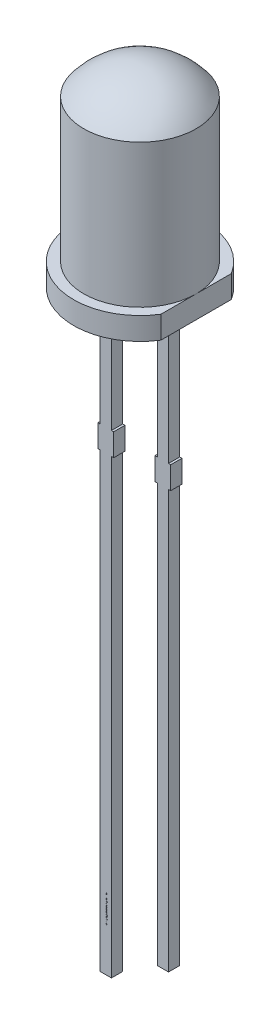
from build123d import *

# Parameters (mm, degrees)
EXTRUDE2_DEPTH     = 1
SKETCH3_3_W        = 0.5
SKETCH3_3_H        = 5.9
SKETCH3_3_H_2      = 1
SKETCH3_3_H_3      = 20.1
SKETCH3_3_W_2      = 0.1
SKETCH3_3_H_4      = 18.6
EXTRUDE4_DEPTH     = 0.25
SKETCH4_W          = 0.058461538
SKETCH4_H          = 0.007179487
CUT_EXTRUDE1_DEPTH = 0.01


with BuildPart() as part:
    # Sketch2 → Extrude2 (new body)
    with BuildSketch(Plane(origin=(0, 0, 0), x_dir=(1, 0, 0), z_dir=(0, 1, 0))):
        with BuildLine():
            Line((2.5, -1.566045976), (2.5, 1.566045976))
            ThreePointArc((2.5, 1.566045976), (-2.95, 0), (2.5, -1.566045976))
        make_face()
    extrude(amount=EXTRUDE2_DEPTH)

    # Sketch3 → Revolve1 (revolve)
    with BuildSketch(Plane.XY):
        with BuildLine():
            Line((0, 8.6), (0, 1))
            Line((0, 1), (2.5, 1))
            Line((2.5, 1), (2.5, 7.362321959))
            ThreePointArc((2.5, 7.362321959), (1.394798098, 8.273640309), (0, 8.6))
        make_face()
    revolve(axis=Axis((0, 1, 0), (0, 1, 0)))

    # Sketch3<3> → Extrude4 (add, symmetric)
    with BuildSketch(Plane.XY):
        with Locations((-1.27, -2.95)):
            Rectangle(SKETCH3_3_W, SKETCH3_3_H)
        with Locations((-1.27, -6.4)):
            Rectangle(SKETCH3_3_W, SKETCH3_3_H_2)
        with Locations((-1.27, -16.95)):
            Rectangle(SKETCH3_3_W, SKETCH3_3_H_3)
        with Locations((-0.97, -6.4)):
            Rectangle(SKETCH3_3_W_2, SKETCH3_3_H_2)
        with Locations((-1.57, -6.4)):
            Rectangle(SKETCH3_3_W_2, SKETCH3_3_H_2)
        with Locations((1.27, -2.95)):
            Rectangle(SKETCH3_3_W, SKETCH3_3_H)
        with Locations((1.27, -6.4)):
            Rectangle(SKETCH3_3_W, SKETCH3_3_H_2)
        with Locations((0.97, -6.4)):
            Rectangle(SKETCH3_3_W_2, SKETCH3_3_H_2)
        with Locations((1.57, -6.4)):
            Rectangle(SKETCH3_3_W_2, SKETCH3_3_H_2)
        with Locations((1.27, -16.2)):
            Rectangle(SKETCH3_3_W, SKETCH3_3_H_4)
    extrude(amount=EXTRUDE4_DEPTH, both=True)

    # Sketch4 → Cut-Extrude1 (cut)
    # profile 1 of 23: a face of its own
    with BuildSketch(Plane.XY.offset(0.25)):
        with BuildLine():
            Line((-1.211538462, -25.071282051), (-1.211538462, -25.078461538))
            Line((-1.211538462, -25.078461538), (-1.221698718, -25.078461538))
            add(Edge.make_bspline(
                [(-1.221698718, -25.078461538), (-1.220811174, -25.079109431), (-1.219113435, -25.080348752), (-1.216851301, -25.082361506), (-1.214963096, -25.084406845), (-1.213958905, -25.085869443), (-1.213477564, -25.086570513)],
                knots=[0, 0, 0, 0, 1.134266299, 2.169680534, 3.122669868, 4, 4, 4, 4], degree=3))
            add(Edge.make_bspline(
                [(-1.213477564, -25.086570513), (-1.213020299, -25.087527419), (-1.212113757, -25.089424514), (-1.211194132, -25.092428382), (-1.210628987, -25.095502089), (-1.210551699, -25.097577705), (-1.210512821, -25.098621795)],
                knots=[0, 0, 0, 0, 1.014936303, 2.012140481, 3.000054389, 4, 4, 4, 4], degree=3))
            add(Edge.make_bspline(
                [(-1.210512821, -25.098621795), (-1.210536776, -25.099327895), (-1.210584183, -25.100725229), (-1.210890916, -25.102796097), (-1.211427504, -25.10480771), (-1.21215596, -25.106747018), (-1.213066341, -25.10856307), (-1.214113174, -25.110231135), (-1.215295636, -25.11173073), (-1.216659513, -25.113059427), (-1.218244409, -25.114254119), (-1.220092717, -25.115353073), (-1.22224604, -25.116368503), (-1.223808703, -25.116931277), (-1.22463141, -25.117227564)],
                knots=[0, 0, 0, 0, 1.009798505, 1.998336943, 2.985959917, 3.981996858, 4.955664737, 5.886087062, 6.794002107, 7.679958053, 8.601272429, 9.625787331, 10.750030247, 12, 12, 12, 12], degree=3))
            add(Edge.make_bspline(
                [(-1.22463141, -25.117227564), (-1.224066281, -25.117540964), (-1.222954185, -25.118157691), (-1.221380282, -25.119193249), (-1.219908127, -25.120278227), (-1.21853655, -25.121421872), (-1.217272333, -25.12262015), (-1.216111265, -25.12387869), (-1.21504847, -25.125190366), (-1.213806473, -25.127014073), (-1.212492403, -25.129383404), (-1.211338269, -25.132371499), (-1.210639877, -25.135486039), (-1.210555383, -25.137603334), (-1.210512821, -25.138669872)],
                knots=[0, 0, 0, 0, 0.861170869, 1.694663331, 2.509326413, 3.297991968, 4.073691563, 4.829592376, 5.579160782, 6.321830913, 7.768780219, 9.179854006, 10.579417172, 12, 12, 12, 12], degree=3))
            add(Edge.make_bspline(
                [(-1.210512821, -25.138669872), (-1.210549786, -25.13965002), (-1.21062213, -25.141568264), (-1.211190209, -25.144360887), (-1.212165698, -25.146965271), (-1.213496753, -25.149376176), (-1.21516942, -25.151551257), (-1.217159565, -25.153441916), (-1.21945311, -25.155036667), (-1.221610642, -25.156078464), (-1.223515449, -25.156785099), (-1.22513845, -25.157220784), (-1.226924771, -25.157605692), (-1.228876549, -25.157925263), (-1.231000677, -25.15815883), (-1.23329368, -25.158331875), (-1.235757339, -25.158448996), (-1.237457122, -25.158457272), (-1.238333333, -25.158461538)],
                knots=[0, 0, 0, 0, 1.209669288, 2.367440248, 3.500751976, 4.631527125, 5.755587489, 6.87532382, 8.007944318, 9.190864318, 9.82315674, 10.514484317, 11.263564316, 12.079023757, 12.955305781, 13.901327259, 14.918167583, 16, 16, 16, 16], degree=3))
            Line((-1.238333333, -25.158461538), (-1.27, -25.158461538))
            Line((-1.27, -25.158461538), (-1.27, -25.151282051))
            Line((-1.27, -25.151282051), (-1.238301282, -25.151282051))
            add(Edge.make_bspline(
                [(-1.238301282, -25.151282051), (-1.237553383, -25.151280271), (-1.236116035, -25.15127685), (-1.234053122, -25.151215281), (-1.232172703, -25.151099274), (-1.230477341, -25.150963625), (-1.228963083, -25.150775195), (-1.22763297, -25.15053186), (-1.226476542, -25.150274083), (-1.225194567, -25.149845836), (-1.223780446, -25.149161285), (-1.22225511, -25.148118712), (-1.220928398, -25.146804687), (-1.2197698, -25.145285785), (-1.218846791, -25.143552216), (-1.21816268, -25.141649606), (-1.217758266, -25.13958437), (-1.217714664, -25.138153515), (-1.217692308, -25.137419872)],
                knots=[0, 0, 0, 0, 1.253542879, 2.409118771, 3.458568974, 4.411070626, 5.259544058, 6.014735414, 6.677123945, 7.243402448, 8.276608576, 9.299873988, 10.325604302, 11.392892819, 12.490509435, 13.603538441, 14.771260462, 16, 16, 16, 16], degree=3))
            add(Edge.make_bspline(
                [(-1.217692308, -25.137419872), (-1.217725382, -25.136513319), (-1.217790939, -25.134716417), (-1.218435408, -25.132097718), (-1.21943119, -25.129588087), (-1.220852904, -25.127254981), (-1.222563546, -25.125106048), (-1.224596485, -25.123256842), (-1.226896651, -25.121729269), (-1.229025705, -25.120694888), (-1.230938151, -25.120041419), (-1.232608948, -25.119609946), (-1.234507955, -25.119274326), (-1.236622412, -25.118959571), (-1.238966873, -25.118754137), (-1.241530494, -25.118567431), (-1.244320984, -25.118480097), (-1.246255309, -25.118467881), (-1.247259615, -25.118461538)],
                knots=[0, 0, 0, 0, 1.090512009, 2.161531735, 3.230072964, 4.332825141, 5.440581378, 6.529496625, 7.62916386, 8.757669174, 9.370357692, 10.061947597, 10.834545503, 11.692923569, 12.636967211, 13.669242667, 14.789864225, 16, 16, 16, 16], degree=3))
            Line((-1.247259615, -25.118461538), (-1.27, -25.118461538))
            Line((-1.27, -25.118461538), (-1.27, -25.111282051))
            Line((-1.27, -25.111282051), (-1.240272436, -25.111282051))
            add(Edge.make_bspline(
                [(-1.240272436, -25.111282051), (-1.239433722, -25.111280317), (-1.237820121, -25.111276981), (-1.235506333, -25.111214736), (-1.233401212, -25.11110199), (-1.231510043, -25.110956368), (-1.229827687, -25.110798319), (-1.228359663, -25.110548202), (-1.227099862, -25.11028748), (-1.225704795, -25.109889594), (-1.224191484, -25.109200424), (-1.222565891, -25.108152122), (-1.221133257, -25.106849839), (-1.219918391, -25.105302581), (-1.218922585, -25.103555419), (-1.218194012, -25.101633184), (-1.217773785, -25.099548021), (-1.217719979, -25.098110884), (-1.217692308, -25.097371795)],
                knots=[0, 0, 0, 0, 1.320226356, 2.539982809, 3.643122147, 4.638255983, 5.52602392, 6.301561104, 6.98107216, 7.550523949, 8.58191082, 9.584830316, 10.584890324, 11.614493144, 12.668965657, 13.738783174, 14.837104585, 16, 16, 16, 16], degree=3))
            add(Edge.make_bspline(
                [(-1.217692308, -25.097371795), (-1.21772729, -25.096502853), (-1.217797007, -25.094771082), (-1.218424534, -25.092227037), (-1.219407484, -25.089770222), (-1.220771137, -25.087439828), (-1.222460259, -25.085298709), (-1.224446883, -25.083424216), (-1.2267063, -25.081848458), (-1.228812882, -25.080802926), (-1.230677493, -25.080129193), (-1.232262377, -25.079679465), (-1.234024428, -25.079302325), (-1.235959791, -25.078982653), (-1.238072482, -25.078742104), (-1.240356531, -25.078598186), (-1.242819151, -25.078471679), (-1.244519037, -25.078465002), (-1.245400641, -25.078461538)],
                knots=[0, 0, 0, 0, 1.098813768, 2.189896819, 3.297771711, 4.440532809, 5.596253211, 6.739894833, 7.8864334, 9.072265856, 9.705655743, 10.395080422, 11.156654178, 11.986235968, 12.878145268, 13.847797945, 14.883813667, 16, 16, 16, 16], degree=3))
            Line((-1.245400641, -25.078461538), (-1.27, -25.078461538))
            Line((-1.27, -25.078461538), (-1.27, -25.071282051))
            Line((-1.27, -25.071282051), (-1.211538462, -25.071282051))
        make_face()
    # profile 2 of 23: a face of its own
    with BuildSketch(Plane.XY.offset(0.25)):
        with BuildLine():
            add(Edge.make_bspline(
                [(-1.210512821, -25.026698718), (-1.210536109, -25.027795689), (-1.210581773, -25.02994658), (-1.211072229, -25.033096089), (-1.211815974, -25.036099374), (-1.212862891, -25.038969319), (-1.214236487, -25.041682182), (-1.215897574, -25.044262187), (-1.217857389, -25.046704163), (-1.219374273, -25.048167485), (-1.220144231, -25.048910256)],
                knots=[0, 0, 0, 0, 1.054042676, 2.066720093, 3.05716247, 4.025731183, 4.997454851, 5.974904663, 6.97207755, 8, 8, 8, 8], degree=3))
            add(Edge.make_bspline(
                [(-1.220144231, -25.048910256), (-1.22088055, -25.049549844), (-1.22233894, -25.050816641), (-1.22470364, -25.052441), (-1.227152556, -25.05384035), (-1.229718209, -25.05496179), (-1.232378202, -25.055846019), (-1.235141676, -25.056473806), (-1.23800253, -25.056847222), (-1.239945475, -25.056897575), (-1.240929487, -25.056923077)],
                knots=[0, 0, 0, 0, 1.025258237, 2.030674902, 3.01204498, 3.988269485, 4.97094183, 5.956517959, 6.965070386, 8, 8, 8, 8], degree=3))
            add(Edge.make_bspline(
                [(-1.240929487, -25.056923077), (-1.241919203, -25.056900646), (-1.243874927, -25.056856323), (-1.24675537, -25.05643704), (-1.249548394, -25.055784901), (-1.252242307, -25.054851601), (-1.254845344, -25.053654845), (-1.257346129, -25.052194485), (-1.259749624, -25.050460284), (-1.262035314, -25.048494449), (-1.264142215, -25.046321945), (-1.265977404, -25.043964603), (-1.267556296, -25.04146704), (-1.268810375, -25.038795162), (-1.26982125, -25.035987001), (-1.270518314, -25.033024697), (-1.270943541, -25.029910891), (-1.27099789, -25.027784504), (-1.271025641, -25.026698718)],
                knots=[0, 0, 0, 0, 0.998669827, 1.973418153, 2.932281609, 3.89081133, 4.846438734, 5.82045571, 6.809776312, 7.834649874, 8.860672198, 9.859676908, 10.845817165, 11.837296335, 12.833502054, 13.853824644, 14.904110009, 16, 16, 16, 16], degree=3))
            add(Edge.make_bspline(
                [(-1.271025641, -25.026698718), (-1.27099766, -25.025607665), (-1.270942858, -25.023470781), (-1.270521477, -25.020345251), (-1.269813802, -25.017370474), (-1.26882289, -25.014549031), (-1.267545995, -25.011877163), (-1.265983548, -25.009370378), (-1.264141286, -25.007011924), (-1.262035566, -25.00483874), (-1.259749559, -25.002873087), (-1.257346146, -25.001138839), (-1.25484534, -24.999678491), (-1.252242308, -24.998481731), (-1.249548394, -24.997548433), (-1.24675537, -24.996896293), (-1.243874927, -24.996477011), (-1.241919203, -24.996432687), (-1.240929487, -24.996410256)],
                knots=[0, 0, 0, 0, 1.099861214, 2.154133753, 3.1731438, 4.178222029, 5.163564916, 6.153006591, 7.15072618, 8.175428628, 9.198983792, 10.187031731, 11.15979573, 12.114193814, 13.071490482, 14.029120454, 15.002614863, 16, 16, 16, 16], degree=3))
            add(Edge.make_bspline(
                [(-1.240929487, -24.996410256), (-1.239950823, -24.996435932), (-1.238013237, -24.996486765), (-1.235157761, -24.996859806), (-1.232398964, -24.997485144), (-1.229749239, -24.998370433), (-1.227194829, -24.999502209), (-1.224739861, -25.000881896), (-1.222385854, -25.002522824), (-1.22092935, -25.003784583), (-1.220192308, -25.004423077)],
                knots=[0, 0, 0, 0, 1.031353054, 2.041901799, 3.029428768, 4.008703097, 4.981709435, 5.96992636, 6.972712378, 8, 8, 8, 8], degree=3))
            add(Edge.make_bspline(
                [(-1.220192308, -25.004423077), (-1.219415802, -25.00516479), (-1.217888667, -25.006623498), (-1.215932718, -25.009076746), (-1.214249236, -25.011645653), (-1.212876331, -25.014376015), (-1.211817873, -25.01725394), (-1.211068758, -25.020279546), (-1.210583943, -25.023440519), (-1.210536764, -25.025601828), (-1.210512821, -25.026698718)],
                knots=[0, 0, 0, 0, 1.027951202, 2.021646915, 2.998468564, 3.9668038, 4.943370589, 5.93035926, 6.949632805, 8, 8, 8, 8], degree=3))
        make_face()
        with BuildLine():
            add(Edge.make_bspline(
                [(-1.217692308, -25.026666667), (-1.217714357, -25.025890951), (-1.217757886, -25.024359544), (-1.218088929, -25.022105369), (-1.218613507, -25.019935355), (-1.219358508, -25.017845107), (-1.220321654, -25.01584271), (-1.221497968, -25.013925961), (-1.222893716, -25.012100008), (-1.224481155, -25.01037888), (-1.226205393, -25.008780768), (-1.228059476, -25.007399874), (-1.229990213, -25.006223506), (-1.232007626, -25.005244549), (-1.234130822, -25.004515175), (-1.23633611, -25.003985524), (-1.238627886, -25.003654771), (-1.240185853, -25.003611654), (-1.240977564, -25.003589744)],
                knots=[0, 0, 0, 0, 1.021589593, 2.016807015, 2.994807536, 3.958602519, 4.934347097, 5.916793557, 6.916107818, 7.957073844, 8.998039869, 10.008589932, 10.997041759, 11.972786337, 12.956492182, 13.948170289, 14.957322718, 16, 16, 16, 16], degree=3))
            add(Edge.make_bspline(
                [(-1.240977564, -25.003589744), (-1.242000513, -25.003626374), (-1.244030875, -25.003699079), (-1.247020178, -25.004293309), (-1.249895389, -25.005280354), (-1.252621889, -25.006641422), (-1.255148918, -25.008317619), (-1.257421235, -25.010277587), (-1.259351209, -25.012548424), (-1.26097435, -25.015052804), (-1.262252572, -25.017755235), (-1.263169227, -25.020610412), (-1.263757086, -25.023592336), (-1.263816205, -25.025632921), (-1.263846154, -25.026666667)],
                knots=[0, 0, 0, 0, 1.016977094, 2.018509362, 3.018404954, 4.033172147, 5.041280572, 6.028085189, 7.007940189, 7.995502847, 8.989109012, 9.972200833, 10.97273166, 12, 12, 12, 12], degree=3))
            add(Edge.make_bspline(
                [(-1.263846154, -25.026666667), (-1.263816378, -25.027700472), (-1.263757602, -25.029741174), (-1.263166249, -25.032727247), (-1.262256558, -25.035590249), (-1.260972906, -25.03829549), (-1.259357344, -25.04080101), (-1.25741024, -25.043055632), (-1.255154891, -25.045032479), (-1.252625239, -25.046710336), (-1.249891151, -25.048049474), (-1.247020708, -25.04904116), (-1.24403074, -25.049633965), (-1.242000468, -25.049706862), (-1.240977564, -25.04974359)],
                knots=[0, 0, 0, 0, 1.027082318, 2.027431966, 3.015401697, 4.008827937, 4.996211763, 5.971861488, 6.96198607, 7.969911943, 8.982141629, 9.981856156, 10.983207064, 12, 12, 12, 12], degree=3))
            add(Edge.make_bspline(
                [(-1.240977564, -25.04974359), (-1.24018579, -25.049721842), (-1.238627699, -25.049679047), (-1.236336827, -25.04934596), (-1.23412646, -25.048824536), (-1.232016182, -25.048063223), (-1.229980359, -25.047117865), (-1.228065273, -25.04591288), (-1.226204215, -25.044538417), (-1.224482195, -25.042937373), (-1.222887916, -25.041216439), (-1.221503052, -25.039376769), (-1.220320982, -25.037459129), (-1.219358389, -25.035456099), (-1.218616374, -25.033370581), (-1.218086644, -25.031207156), (-1.217759093, -25.028962964), (-1.217714712, -25.027436995), (-1.217692308, -25.026666667)],
                knots=[0, 0, 0, 0, 1.043020522, 2.052505155, 3.044509714, 4.030878336, 5.003918577, 5.996372628, 7.007255355, 8.048564058, 9.08987276, 10.095126797, 11.077896669, 12.053962454, 13.01807471, 13.98956039, 14.985105429, 16, 16, 16, 16], degree=3))
        make_face(mode=Mode.SUBTRACT)
    # profile 3 of 23: a face of its own
    with BuildSketch(Plane.XY.offset(0.25)):
        with BuildLine():
            Line((-1.224214744, -24.984102564), (-1.227948718, -24.978092949))
            add(Edge.make_bspline(
                [(-1.227948718, -24.978092949), (-1.227129714, -24.977434017), (-1.225517643, -24.976137022), (-1.223438407, -24.973884172), (-1.221645308, -24.971482094), (-1.220203579, -24.968885498), (-1.219065483, -24.966117134), (-1.218274522, -24.963171299), (-1.217777358, -24.960048902), (-1.217721122, -24.957907917), (-1.217692308, -24.956810897)],
                knots=[0, 0, 0, 0, 1.026629843, 2.020746545, 2.988156479, 3.951609825, 4.916760838, 5.907688704, 6.927920211, 8, 8, 8, 8], degree=3))
            add(Edge.make_bspline(
                [(-1.217692308, -24.956810897), (-1.217716466, -24.955934122), (-1.217764044, -24.954207338), (-1.218061406, -24.951672325), (-1.21860187, -24.949257696), (-1.219313619, -24.946948001), (-1.220268912, -24.944760814), (-1.221424418, -24.942690006), (-1.22278506, -24.940728652), (-1.224341037, -24.938907909), (-1.226050062, -24.937248576), (-1.227854865, -24.935781034), (-1.229768083, -24.934556175), (-1.231753404, -24.933535158), (-1.233844982, -24.932766963), (-1.236017407, -24.932202051), (-1.238284974, -24.931857715), (-1.239827873, -24.931815993), (-1.240608974, -24.931794872)],
                knots=[0, 0, 0, 0, 1.11253269, 2.191102883, 3.232049486, 4.248096668, 5.252846381, 6.25411548, 7.252444123, 8.276484619, 9.287796331, 10.271127345, 11.222403915, 12.165070373, 13.097940083, 14.043161362, 15.009338842, 16, 16, 16, 16], degree=3))
            add(Edge.make_bspline(
                [(-1.240608974, -24.931794872), (-1.241632315, -24.931835449), (-1.243665209, -24.931916055), (-1.246665188, -24.932550591), (-1.24957117, -24.933582605), (-1.252344314, -24.935022797), (-1.254915516, -24.9368146), (-1.257240391, -24.93890541), (-1.259222142, -24.941341612), (-1.260880715, -24.944051701), (-1.262219402, -24.946986745), (-1.263164031, -24.950123476), (-1.263737393, -24.953435183), (-1.263809427, -24.955702805), (-1.263846154, -24.956858974)],
                knots=[0, 0, 0, 0, 0.966447457, 1.919872872, 2.884287729, 3.873230387, 4.863319139, 5.838939256, 6.818209587, 7.819967013, 8.834377336, 9.85802846, 10.90789553, 12, 12, 12, 12], degree=3))
            add(Edge.make_bspline(
                [(-1.263846154, -24.956858974), (-1.263816451, -24.957918521), (-1.263758077, -24.960000813), (-1.263265987, -24.963044636), (-1.262460418, -24.965942463), (-1.261337043, -24.968694189), (-1.259884985, -24.971294787), (-1.258093919, -24.973727454), (-1.256015368, -24.976040596), (-1.2544081, -24.977400526), (-1.253589744, -24.978092949)],
                knots=[0, 0, 0, 0, 1.039848629, 2.043578496, 3.018386758, 3.987534228, 4.954977003, 5.934852016, 6.948509513, 8, 8, 8, 8], degree=3))
            Line((-1.253589744, -24.978092949), (-1.257532051, -24.984102564))
            add(Edge.make_bspline(
                [(-1.257532051, -24.984102564), (-1.258055264, -24.983746271), (-1.259099952, -24.983034867), (-1.260573024, -24.981845709), (-1.261951565, -24.980562799), (-1.263235163, -24.979192165), (-1.264446335, -24.977751202), (-1.265550756, -24.976202402), (-1.266576372, -24.974572132), (-1.26750581, -24.972852913), (-1.268339436, -24.971061676), (-1.269060862, -24.969198367), (-1.269670825, -24.967271402), (-1.270164384, -24.965285112), (-1.270554848, -24.963236362), (-1.270814539, -24.961126713), (-1.271008212, -24.958956559), (-1.271019781, -24.957489769), (-1.271025641, -24.956746795)],
                knots=[0, 0, 0, 0, 0.954067324, 1.904967979, 2.850944488, 3.791040077, 4.734579251, 5.686741025, 6.656553487, 7.63677735, 8.631289747, 9.633371755, 10.647134148, 11.676547777, 12.717490898, 13.789379914, 14.88025357, 16, 16, 16, 16], degree=3))
            add(Edge.make_bspline(
                [(-1.271025641, -24.956746795), (-1.271005269, -24.955612832), (-1.270965339, -24.953390256), (-1.270526289, -24.95013717), (-1.2698644, -24.947028286), (-1.268914372, -24.944064666), (-1.267691405, -24.941245852), (-1.266197538, -24.938574455), (-1.264420333, -24.93605939), (-1.262391549, -24.933725262), (-1.260191472, -24.931582303), (-1.257818799, -24.929739499), (-1.255352683, -24.928149674), (-1.252764405, -24.926838568), (-1.250044171, -24.925848146), (-1.247213277, -24.925143265), (-1.244271787, -24.924694489), (-1.242266583, -24.924641997), (-1.24125, -24.924615385)],
                knots=[0, 0, 0, 0, 1.112900083, 2.181292239, 3.217426397, 4.231060065, 5.231907716, 6.230057215, 7.231385915, 8.250448267, 9.26326716, 10.242335464, 11.195469137, 12.140906363, 13.085222324, 14.031808558, 15.002181388, 16, 16, 16, 16], degree=3))
            add(Edge.make_bspline(
                [(-1.24125, -24.924615385), (-1.240560318, -24.924626078), (-1.239188425, -24.92464735), (-1.237149478, -24.924868382), (-1.235146644, -24.925199437), (-1.233182796, -24.925669427), (-1.231251996, -24.926259187), (-1.229364553, -24.927000403), (-1.227509487, -24.927867836), (-1.225709638, -24.92887703), (-1.223975905, -24.929990238), (-1.22231816, -24.931199918), (-1.22077886, -24.932526872), (-1.219319479, -24.933943025), (-1.217983591, -24.935469835), (-1.216713479, -24.937078856), (-1.215574947, -24.938809795), (-1.214511788, -24.940618536), (-1.213566815, -24.942507416), (-1.212752237, -24.944463141), (-1.212056206, -24.946474433), (-1.211505137, -24.948544373), (-1.211043027, -24.950659259), (-1.210752333, -24.952835746), (-1.210546932, -24.955065511), (-1.210524286, -24.956575363), (-1.210512821, -24.957339744)],
                knots=[0, 0, 0, 0, 0.991083503, 1.971428668, 2.944771278, 3.907728914, 4.872032831, 5.84458753, 6.820199395, 7.813689706, 8.808455339, 9.780676499, 10.761021664, 11.727616056, 12.70141294, 13.675300653, 14.672050164, 15.67696011, 16.690052069, 17.705469636, 18.720567748, 19.746988726, 20.783187267, 21.830086354, 22.901455311, 24, 24, 24, 24], degree=3))
            add(Edge.make_bspline(
                [(-1.210512821, -24.957339744), (-1.210533887, -24.958297006), (-1.210575914, -24.960206746), (-1.210929795, -24.963039636), (-1.211462886, -24.965830991), (-1.212254283, -24.968530938), (-1.213205307, -24.971105442), (-1.214293877, -24.973510689), (-1.215527309, -24.975708966), (-1.216898452, -24.977720695), (-1.218437222, -24.979553863), (-1.220170197, -24.981228118), (-1.222086896, -24.982778592), (-1.223499607, -24.983657598), (-1.224214744, -24.984102564)],
                knots=[0, 0, 0, 0, 1.095247575, 2.185020588, 3.262981163, 4.344680461, 5.40090428, 6.402280576, 7.363136638, 8.282296962, 9.184898179, 10.097200524, 11.036773704, 12, 12, 12, 12], degree=3))
        make_face()
    # profile 4 of 23: a face of its own
    with BuildSketch(Plane.XY.offset(0.25)):
        with BuildLine():
            add(Edge.make_bspline(
                [(-1.257692308, -24.903589744), (-1.257717905, -24.904035542), (-1.257767791, -24.904904341), (-1.258134429, -24.906162388), (-1.258753053, -24.907312015), (-1.259603049, -24.908329713), (-1.260617828, -24.909175551), (-1.261764535, -24.909801293), (-1.263026229, -24.910184737), (-1.26390756, -24.910232134), (-1.264358974, -24.91025641)],
                knots=[0, 0, 0, 0, 1.020591893, 1.988988293, 2.974634352, 3.991697318, 5.008760285, 5.983632262, 6.967224335, 8, 8, 8, 8], degree=3))
            add(Edge.make_bspline(
                [(-1.264358974, -24.91025641), (-1.264799534, -24.910231164), (-1.265669812, -24.910181293), (-1.266921959, -24.909802089), (-1.268069429, -24.909170652), (-1.269098003, -24.908335487), (-1.269949818, -24.907311768), (-1.270562926, -24.906159608), (-1.270955219, -24.904907357), (-1.271001787, -24.90403605), (-1.271025641, -24.903589744)],
                knots=[0, 0, 0, 0, 1.009852967, 1.994853009, 2.971120474, 3.99910934, 5.017628188, 6.004685157, 6.977947174, 8, 8, 8, 8], degree=3))
            add(Edge.make_bspline(
                [(-1.271025641, -24.903589744), (-1.271000892, -24.903143759), (-1.270952291, -24.902267957), (-1.27057076, -24.901011014), (-1.269943941, -24.899865829), (-1.269099578, -24.89884191), (-1.2680641, -24.898013682), (-1.266929771, -24.897353155), (-1.265666195, -24.897004295), (-1.264798822, -24.896950405), (-1.264358974, -24.896923077)],
                knots=[0, 0, 0, 0, 1.021616397, 2.006195831, 2.982046417, 4.000130345, 5.027680246, 6.00943514, 6.990578253, 8, 8, 8, 8], degree=3))
            add(Edge.make_bspline(
                [(-1.264358974, -24.896923077), (-1.263908298, -24.896949509), (-1.263029905, -24.897001027), (-1.261756726, -24.897353964), (-1.260623105, -24.898008692), (-1.25960149, -24.898847697), (-1.258758912, -24.899865577), (-1.258126714, -24.901008312), (-1.257770676, -24.902270921), (-1.25771878, -24.903144253), (-1.257692308, -24.903589744)],
                knots=[0, 0, 0, 0, 1.032329927, 2.012066096, 2.992413168, 4.009037178, 5.025661188, 6.000112418, 6.979848586, 8, 8, 8, 8], degree=3))
        make_face()
    # profile 5 of 23: a face of its own
    with BuildSketch(Plane.XY.offset(0.25)):
        Polygon((-1.19, -24.848717949), (-1.27, -24.885641026), (-1.27, -24.877836538), (-1.244358974, -24.866009615), (-1.244358974, -24.82974359), (-1.27, -24.817580128), (-1.27, -24.80974359), (-1.19, -24.847692308), align=None)
        Polygon((-1.205592949, -24.848125), (-1.236153846, -24.833637821), (-1.236153846, -24.862227564), align=None, mode=Mode.SUBTRACT)
    # profile 6 of 23: a face of its own
    with BuildSketch(Plane.XY.offset(0.25)):
        with BuildLine():
            Line((-1.254567308, -24.752307692), (-1.250512821, -24.759070513))
            add(Edge.make_bspline(
                [(-1.250512821, -24.759070513), (-1.251565721, -24.759699501), (-1.253583037, -24.760904618), (-1.256308935, -24.762914935), (-1.258625784, -24.764997973), (-1.260520107, -24.767169158), (-1.26201151, -24.769415237), (-1.263067561, -24.771750872), (-1.263726212, -24.774168194), (-1.263806214, -24.77581331), (-1.263846154, -24.776634615)],
                knots=[0, 0, 0, 0, 1.272034388, 2.437168799, 3.508375237, 4.49857839, 5.41946034, 6.295179144, 7.148887113, 8, 8, 8, 8], degree=3))
            add(Edge.make_bspline(
                [(-1.263846154, -24.776634615), (-1.263826618, -24.777336029), (-1.26378789, -24.778726584), (-1.263415757, -24.78077372), (-1.262844052, -24.78276188), (-1.262025283, -24.784650062), (-1.261034707, -24.786412302), (-1.259838159, -24.787957408), (-1.258498817, -24.789293994), (-1.257003526, -24.790384319), (-1.255400946, -24.791230746), (-1.253741257, -24.791843244), (-1.252031762, -24.792233062), (-1.250872776, -24.792282678), (-1.250288462, -24.792307692)],
                knots=[0, 0, 0, 0, 1.095270387, 2.171376115, 3.241375676, 4.322296363, 5.380636668, 6.392615365, 7.366724986, 8.328592944, 9.273498763, 10.190095884, 11.087518669, 12, 12, 12, 12], degree=3))
            add(Edge.make_bspline(
                [(-1.250288462, -24.792307692), (-1.249622385, -24.792273994), (-1.248268349, -24.79220549), (-1.246270642, -24.791626484), (-1.244293669, -24.790715644), (-1.243070783, -24.789875355), (-1.242435897, -24.789439103)],
                knots=[0, 0, 0, 0, 0.938893495, 1.908633276, 2.914225137, 4, 4, 4, 4], degree=3))
            add(Edge.make_bspline(
                [(-1.242435897, -24.789439103), (-1.241976748, -24.789081931), (-1.241009991, -24.788329893), (-1.239595008, -24.787019112), (-1.238099789, -24.785521015), (-1.236530405, -24.783828114), (-1.234915515, -24.781906758), (-1.233221459, -24.779796398), (-1.231453328, -24.77748611), (-1.230284079, -24.775857924), (-1.229679487, -24.775016026)],
                knots=[0, 0, 0, 0, 0.72226686, 1.520759855, 2.393439377, 3.351307446, 4.386958158, 5.510256019, 6.712608938, 8, 8, 8, 8], degree=3))
            add(Edge.make_bspline(
                [(-1.229679487, -24.775016026), (-1.229079839, -24.774174447), (-1.227933358, -24.772565411), (-1.226234006, -24.770313478), (-1.224670414, -24.768302454), (-1.223264363, -24.766522092), (-1.221954527, -24.765018452), (-1.220811107, -24.763736565), (-1.219773046, -24.762723725), (-1.219100178, -24.762160103), (-1.218798077, -24.761907051)],
                knots=[0, 0, 0, 0, 1.452255772, 2.776602448, 3.96446981, 5.032613149, 5.964194703, 6.766668629, 7.446264616, 8, 8, 8, 8], degree=3))
            add(Edge.make_bspline(
                [(-1.218798077, -24.761907051), (-1.218327196, -24.761553393), (-1.217401146, -24.760857877), (-1.21595372, -24.759939797), (-1.214472046, -24.759159473), (-1.21295214, -24.758547763), (-1.211415342, -24.758032649), (-1.209841599, -24.757686182), (-1.208237974, -24.757469236), (-1.207158808, -24.757447019), (-1.20661859, -24.757435897)],
                knots=[0, 0, 0, 0, 1.068054152, 2.10047183, 3.106115577, 4.101338837, 5.06977816, 6.043150881, 7.020423561, 8, 8, 8, 8], degree=3))
            add(Edge.make_bspline(
                [(-1.20661859, -24.757435897), (-1.205772124, -24.757465601), (-1.204097285, -24.757524372), (-1.201651894, -24.758025472), (-1.199310074, -24.758807155), (-1.197123408, -24.759937697), (-1.19509701, -24.761335466), (-1.193261838, -24.762987409), (-1.191705931, -24.764948727), (-1.19036227, -24.767112672), (-1.189301394, -24.769465991), (-1.188496877, -24.771927568), (-1.188047103, -24.774508197), (-1.187981835, -24.776259045), (-1.187948718, -24.777147436)],
                knots=[0, 0, 0, 0, 1.005541892, 1.989591032, 2.955705311, 3.932863626, 4.905387107, 5.876519979, 6.856563935, 7.871847665, 8.897921447, 9.918317993, 10.943742853, 12, 12, 12, 12], degree=3))
            add(Edge.make_bspline(
                [(-1.187948718, -24.777147436), (-1.187980624, -24.778090299), (-1.188043898, -24.779960108), (-1.18861375, -24.782715675), (-1.189534241, -24.785373819), (-1.190594424, -24.787513494), (-1.191648547, -24.789185199), (-1.192609069, -24.790459983), (-1.193714765, -24.791751817), (-1.194968697, -24.793071085), (-1.196382335, -24.794395443), (-1.197946008, -24.79574455), (-1.199650158, -24.797121562), (-1.200866718, -24.798007411), (-1.201490385, -24.798461538)],
                knots=[0, 0, 0, 0, 1.286821612, 2.551921131, 3.825787379, 5.12137259, 5.803616487, 6.523126609, 7.299589446, 8.125436757, 9.008162487, 9.944516264, 10.946261234, 12, 12, 12, 12], degree=3))
            Line((-1.201490385, -24.798461538), (-1.206410256, -24.791971154))
            add(Edge.make_bspline(
                [(-1.206410256, -24.791971154), (-1.205905372, -24.791579247), (-1.204933083, -24.790824526), (-1.203571453, -24.789678709), (-1.202327647, -24.78859874), (-1.201247303, -24.78753473), (-1.200271248, -24.786542878), (-1.199435619, -24.785580195), (-1.198732104, -24.784660576), (-1.197981698, -24.783501236), (-1.197233113, -24.782040994), (-1.196613156, -24.780209777), (-1.19622719, -24.778301318), (-1.196178563, -24.777005039), (-1.196153846, -24.776346154)],
                knots=[0, 0, 0, 0, 1.181667846, 2.275615987, 3.290305621, 4.226321945, 5.078535498, 5.862783384, 6.581873284, 7.217493746, 8.414623899, 9.604724551, 10.782505457, 12, 12, 12, 12], degree=3))
            add(Edge.make_bspline(
                [(-1.196153846, -24.776346154), (-1.196181542, -24.775519719), (-1.196234951, -24.773926017), (-1.196818265, -24.771663383), (-1.197736708, -24.769626951), (-1.199023907, -24.767877178), (-1.200548959, -24.766420333), (-1.202303904, -24.765366494), (-1.204241787, -24.764732204), (-1.205593597, -24.764654804), (-1.206282051, -24.764615385)],
                knots=[0, 0, 0, 0, 1.14458467, 2.207223713, 3.21896685, 4.227309161, 5.202851033, 6.127160689, 7.046193047, 8, 8, 8, 8], degree=3))
            add(Edge.make_bspline(
                [(-1.206282051, -24.764615385), (-1.206710547, -24.764624789), (-1.20756824, -24.764643612), (-1.208838746, -24.764888432), (-1.210097974, -24.76523558), (-1.211351524, -24.765743651), (-1.212628885, -24.766428001), (-1.21392661, -24.76735851), (-1.215277463, -24.768522616), (-1.216155181, -24.769416092), (-1.21661859, -24.769887821)],
                knots=[0, 0, 0, 0, 0.858526328, 1.718456515, 2.587092892, 3.476767204, 4.426280253, 5.487868114, 6.673670035, 8, 8, 8, 8], degree=3))
            add(Edge.make_bspline(
                [(-1.21661859, -24.769887821), (-1.216774865, -24.770062938), (-1.217146138, -24.770478976), (-1.217753962, -24.771239568), (-1.218503739, -24.772243975), (-1.219431449, -24.773465968), (-1.220507597, -24.774928079), (-1.221718422, -24.776630469), (-1.223103233, -24.778554161), (-1.224071405, -24.779919234), (-1.224583333, -24.780641026)],
                knots=[0, 0, 0, 0, 0.420754252, 0.999615792, 1.744751191, 2.668019286, 3.750313428, 4.999500688, 6.413464383, 8, 8, 8, 8], degree=3))
            add(Edge.make_bspline(
                [(-1.224583333, -24.780641026), (-1.225215136, -24.781509275), (-1.226438534, -24.78319052), (-1.228276607, -24.785582693), (-1.23007427, -24.787751694), (-1.231820044, -24.789705139), (-1.233500686, -24.791462326), (-1.235136416, -24.793003759), (-1.236715514, -24.794345146), (-1.23874003, -24.795789243), (-1.241226455, -24.79726485), (-1.244272815, -24.798532084), (-1.247331017, -24.799331132), (-1.249386487, -24.799435624), (-1.250400641, -24.799487179)],
                knots=[0, 0, 0, 0, 1.163667725, 2.253281268, 3.268753668, 4.215851969, 5.092017293, 5.902905408, 6.650798638, 7.335211899, 8.59617414, 9.77448103, 10.901945474, 12, 12, 12, 12], degree=3))
            add(Edge.make_bspline(
                [(-1.250400641, -24.799487179), (-1.251117855, -24.799472151), (-1.252538356, -24.799442385), (-1.254624268, -24.799100543), (-1.256649811, -24.798599071), (-1.258591781, -24.797845624), (-1.260476165, -24.796918813), (-1.262285604, -24.795774069), (-1.263995224, -24.794394081), (-1.265640603, -24.792860279), (-1.267126853, -24.791155716), (-1.268456137, -24.789358418), (-1.269568739, -24.787456715), (-1.270464387, -24.785459814), (-1.271175983, -24.783378759), (-1.271687464, -24.781211361), (-1.272002101, -24.778951585), (-1.272034705, -24.777415561), (-1.272051282, -24.776634615)],
                knots=[0, 0, 0, 0, 0.983610584, 1.948120116, 2.894308362, 3.843560551, 4.801159957, 5.773581695, 6.77566113, 7.813174769, 8.857584665, 9.875476876, 10.877851407, 11.875574773, 12.875048225, 13.892438445, 14.928473903, 16, 16, 16, 16], degree=3))
            add(Edge.make_bspline(
                [(-1.272051282, -24.776634615), (-1.272039464, -24.776030406), (-1.272015977, -24.774829596), (-1.271813254, -24.77305822), (-1.271515958, -24.771319372), (-1.27106269, -24.769634885), (-1.270499802, -24.767983784), (-1.269810628, -24.766380787), (-1.268990202, -24.764821999), (-1.268037163, -24.7633056), (-1.266938821, -24.761817301), (-1.265669525, -24.760364732), (-1.264238045, -24.758931275), (-1.262629699, -24.757543209), (-1.260861672, -24.756174947), (-1.258919149, -24.754851935), (-1.256812213, -24.753547232), (-1.255329586, -24.752728589), (-1.254567308, -24.752307692)],
                knots=[0, 0, 0, 0, 0.915384692, 1.819241058, 2.699029451, 3.586605375, 4.459625921, 5.340865773, 6.228072412, 7.126546901, 8.052715223, 9.028303326, 10.047266019, 11.120332924, 12.245748783, 13.433636234, 14.680528497, 16, 16, 16, 16], degree=3))
        make_face()
    # profile 7 of 23: a face of its own
    with BuildSketch(Plane.XY.offset(0.25)):
        with BuildLine():
            Line((-1.19, -24.687692308), (-1.19, -24.694871795))
            Line((-1.19, -24.694871795), (-1.237932692, -24.694871795))
            add(Edge.make_bspline(
                [(-1.237932692, -24.694871795), (-1.238611109, -24.694870726), (-1.239898522, -24.694868699), (-1.24173094, -24.694882242), (-1.243360025, -24.69492017), (-1.244792056, -24.694944083), (-1.246020461, -24.694997279), (-1.247051897, -24.695040663), (-1.247881479, -24.695096447), (-1.248365614, -24.69516349), (-1.248573718, -24.695192308)],
                knots=[0, 0, 0, 0, 1.528628734, 2.90083645, 4.128790002, 5.200304208, 6.127813768, 6.898992206, 7.526736466, 8, 8, 8, 8], degree=3))
            add(Edge.make_bspline(
                [(-1.248573718, -24.695192308), (-1.249324566, -24.695310535), (-1.250783955, -24.695540327), (-1.252860969, -24.696128102), (-1.25473928, -24.696942369), (-1.256456349, -24.697933786), (-1.257986648, -24.699208771), (-1.259407386, -24.700726257), (-1.260634803, -24.702581945), (-1.261764021, -24.704644013), (-1.262670317, -24.706867963), (-1.263355967, -24.709140146), (-1.263773748, -24.711426862), (-1.263822129, -24.712957743), (-1.263846154, -24.713717949)],
                knots=[0, 0, 0, 0, 1.035924841, 2.013479024, 2.933602255, 3.82183108, 4.706948133, 5.639927629, 6.646101806, 7.731477349, 8.84205456, 9.913728764, 10.963998332, 12, 12, 12, 12], degree=3))
            add(Edge.make_bspline(
                [(-1.263846154, -24.713717949), (-1.26382161, -24.714370607), (-1.263772664, -24.715672153), (-1.263469526, -24.717605997), (-1.262923304, -24.719489495), (-1.262218103, -24.721331541), (-1.261287813, -24.723059367), (-1.260205733, -24.724671736), (-1.258955005, -24.726126168), (-1.257551117, -24.727437794), (-1.255981571, -24.728586183), (-1.254251096, -24.729555127), (-1.252365381, -24.730371761), (-1.251035681, -24.730771965), (-1.250352564, -24.730977564)],
                knots=[0, 0, 0, 0, 0.994510594, 1.983277156, 2.972612928, 3.9776239, 4.982470102, 5.955333794, 6.930747147, 7.898149105, 8.876444039, 9.885893618, 10.913904934, 12, 12, 12, 12], degree=3))
            add(Edge.make_bspline(
                [(-1.250352564, -24.730977564), (-1.250070311, -24.731046138), (-1.249441337, -24.73119895), (-1.248377993, -24.731341739), (-1.247123379, -24.73149046), (-1.245668481, -24.73159365), (-1.244018173, -24.731694249), (-1.242163858, -24.731754434), (-1.240112271, -24.731782252), (-1.238680564, -24.731790541), (-1.237932692, -24.731794872)],
                knots=[0, 0, 0, 0, 0.558680831, 1.244966039, 2.062412453, 2.990489873, 4.051219941, 5.244515665, 6.560634259, 8, 8, 8, 8], degree=3))
            Line((-1.237932692, -24.731794872), (-1.19, -24.731794872))
            Line((-1.19, -24.731794872), (-1.19, -24.738974359))
            Line((-1.19, -24.738974359), (-1.238317308, -24.738974359))
            add(Edge.make_bspline(
                [(-1.238317308, -24.738974359), (-1.239188137, -24.738968615), (-1.240887614, -24.738957404), (-1.2433778, -24.738858214), (-1.245740614, -24.738704632), (-1.24797304, -24.738472449), (-1.250077737, -24.738216127), (-1.252051629, -24.737849383), (-1.253907953, -24.737465992), (-1.25564353, -24.736981048), (-1.257281323, -24.736396045), (-1.25886453, -24.735711117), (-1.26038021, -24.73487301), (-1.261850253, -24.733916616), (-1.263276673, -24.732854758), (-1.264625971, -24.731630836), (-1.265942385, -24.730308217), (-1.267182474, -24.728859041), (-1.268327828, -24.727309207), (-1.269313062, -24.72565596), (-1.270178153, -24.723932591), (-1.270861492, -24.722120641), (-1.271390399, -24.720231913), (-1.271779638, -24.718266504), (-1.272001694, -24.71621773), (-1.272034613, -24.714824235), (-1.272051282, -24.71411859)],
                knots=[0, 0, 0, 0, 1.316364231, 2.568964831, 3.766826305, 4.894964518, 5.961692026, 6.970710131, 7.928946231, 8.826316495, 9.692177228, 10.556379512, 11.43093279, 12.306715499, 13.20629939, 14.115652445, 15.057829886, 16.025681089, 16.996391533, 17.967202739, 18.931442607, 19.907779629, 20.889445314, 21.893507297, 22.933303057, 24, 24, 24, 24], degree=3))
            add(Edge.make_bspline(
                [(-1.272051282, -24.71411859), (-1.272033345, -24.71334901), (-1.271998151, -24.711839098), (-1.271796488, -24.709614228), (-1.271416639, -24.707481332), (-1.270932984, -24.705417883), (-1.270265927, -24.703451975), (-1.269486541, -24.701557268), (-1.268529346, -24.699766212), (-1.267464355, -24.698049752), (-1.266266077, -24.696453758), (-1.264960016, -24.694988674), (-1.263567093, -24.693652083), (-1.262072228, -24.692466512), (-1.260487046, -24.691412321), (-1.258807063, -24.690504202), (-1.25703293, -24.68972447), (-1.255799714, -24.689322035), (-1.255176282, -24.68911859)],
                knots=[0, 0, 0, 0, 1.13879206, 2.234305948, 3.301075583, 4.341971843, 5.366689343, 6.369221514, 7.369726634, 8.367512178, 9.355451585, 10.318319045, 11.268648973, 12.207971039, 13.137398894, 14.081662264, 15.030215811, 16, 16, 16, 16], degree=3))
            add(Edge.make_bspline(
                [(-1.255176282, -24.68911859), (-1.254750395, -24.689000255), (-1.253826635, -24.688743583), (-1.252297801, -24.688468719), (-1.25053746, -24.688237655), (-1.248545492, -24.688020385), (-1.246320352, -24.68789218), (-1.243863005, -24.687779781), (-1.241170481, -24.687691516), (-1.239294949, -24.687692036), (-1.238317308, -24.687692308)],
                knots=[0, 0, 0, 0, 0.625038921, 1.35572334, 2.194682327, 3.136881307, 4.189498639, 5.346923369, 6.617055217, 8, 8, 8, 8], degree=3))
            Line((-1.238317308, -24.687692308), (-1.19, -24.687692308))
        make_face()
    # profile 8 of 23: a face of its own
    with BuildSketch(Plane.XY.offset(0.25)):
        Polygon((-1.187948718, -24.654871795), (-1.187948718, -24.662051282), (-1.211538462, -24.662051282), (-1.211538462, -24.672307692), (-1.218717949, -24.672307692), (-1.218717949, -24.662051282), (-1.27, -24.662051282), (-1.27, -24.654871795), (-1.218717949, -24.654871795), (-1.218717949, -24.644615385), (-1.211538462, -24.644615385), (-1.211538462, -24.654871795), align=None)
    # profile 9 of 23: a face of its own
    with BuildSketch(Plane.XY.offset(0.25)):
        with BuildLine():
            Line((-1.187948718, -24.58), (-1.187948718, -24.587179487))
            Line((-1.187948718, -24.587179487), (-1.222580128, -24.587179487))
            add(Edge.make_bspline(
                [(-1.222580128, -24.587179487), (-1.221618069, -24.587951325), (-1.219747862, -24.589451748), (-1.21728308, -24.591961194), (-1.215178911, -24.594569408), (-1.213483181, -24.597320265), (-1.212154828, -24.600175553), (-1.211199412, -24.60315014), (-1.210624865, -24.606249202), (-1.210550433, -24.608357641), (-1.210512821, -24.609423077)],
                knots=[0, 0, 0, 0, 1.125719942, 2.188356526, 3.205611246, 4.180516366, 5.132291467, 6.075069812, 7.02729502, 8, 8, 8, 8], degree=3))
            add(Edge.make_bspline(
                [(-1.210512821, -24.609423077), (-1.210552775, -24.610504885), (-1.210630977, -24.612622245), (-1.211247589, -24.615705662), (-1.212307321, -24.618587675), (-1.213742887, -24.62126369), (-1.2155405, -24.623662873), (-1.217627209, -24.625768891), (-1.220027002, -24.627503619), (-1.22225084, -24.628682175), (-1.224228748, -24.62944969), (-1.225925611, -24.629935417), (-1.227816389, -24.630347293), (-1.229900157, -24.630706142), (-1.232186903, -24.63094531), (-1.234666315, -24.631137415), (-1.237338249, -24.63127402), (-1.239187854, -24.631279314), (-1.240144231, -24.631282051)],
                knots=[0, 0, 0, 0, 1.23557613, 2.418320525, 3.575024647, 4.733016537, 5.875704003, 6.989294038, 8.107658508, 9.246262776, 9.854990416, 10.529125826, 11.260725398, 12.065539328, 12.943870397, 13.886749146, 14.907300446, 16, 16, 16, 16], degree=3))
            Line((-1.240144231, -24.631282051), (-1.27, -24.631282051))
            Line((-1.27, -24.631282051), (-1.27, -24.624102564))
            Line((-1.27, -24.624102564), (-1.2425, -24.624102564))
            add(Edge.make_bspline(
                [(-1.2425, -24.624102564), (-1.241704053, -24.624098214), (-1.240181543, -24.624089894), (-1.238001746, -24.624062389), (-1.236024691, -24.62400099), (-1.234256715, -24.623901771), (-1.232695353, -24.623797421), (-1.231342872, -24.623653802), (-1.230197414, -24.623486711), (-1.229507937, -24.623336568), (-1.229198718, -24.623269231)],
                knots=[0, 0, 0, 0, 1.430932559, 2.737130458, 3.918967929, 4.986496826, 5.920444988, 6.731744033, 7.431208747, 8, 8, 8, 8], degree=3))
            add(Edge.make_bspline(
                [(-1.229198718, -24.623269231), (-1.228291417, -24.623008106), (-1.226547136, -24.622506096), (-1.224177757, -24.621339269), (-1.222157369, -24.619881978), (-1.22051421, -24.618102401), (-1.219219888, -24.616029039), (-1.2183374, -24.613651462), (-1.217774809, -24.610998392), (-1.217720627, -24.60913238), (-1.217692308, -24.608157051)],
                knots=[0, 0, 0, 0, 1.090097712, 2.095706502, 3.037208793, 3.95517211, 4.879102211, 5.845071496, 6.873660557, 8, 8, 8, 8], degree=3))
            add(Edge.make_bspline(
                [(-1.217692308, -24.608157051), (-1.217703184, -24.607579502), (-1.217724707, -24.606436547), (-1.217940796, -24.604741721), (-1.21829391, -24.603097628), (-1.218771728, -24.601488435), (-1.219421912, -24.599948248), (-1.220174602, -24.598432172), (-1.221095933, -24.596983161), (-1.222129665, -24.595575486), (-1.223274117, -24.594265371), (-1.224482047, -24.593046465), (-1.225768332, -24.591959874), (-1.227112335, -24.590975449), (-1.22853249, -24.59012566), (-1.230015103, -24.589383875), (-1.231562123, -24.588754488), (-1.232635839, -24.588441741), (-1.233173077, -24.588285256)],
                knots=[0, 0, 0, 0, 1.024319606, 2.027102035, 3.025350316, 4.005802111, 5.00026367, 5.987881639, 7.005602596, 8.042517216, 9.083927026, 10.089214625, 11.084353441, 12.06828073, 13.041928858, 14.016821737, 15.00770877, 16, 16, 16, 16], degree=3))
            add(Edge.make_bspline(
                [(-1.233173077, -24.588285256), (-1.233562127, -24.588195212), (-1.234409916, -24.587998995), (-1.235808186, -24.587786085), (-1.237433017, -24.587595507), (-1.239281945, -24.587434397), (-1.241361745, -24.587335583), (-1.243658224, -24.587229109), (-1.246185768, -24.587189475), (-1.247943379, -24.587182916), (-1.248862179, -24.587179487)],
                knots=[0, 0, 0, 0, 0.607992626, 1.324890765, 2.152360218, 3.099583803, 4.150613268, 5.323148443, 6.60066238, 8, 8, 8, 8], degree=3))
            Line((-1.248862179, -24.587179487), (-1.27, -24.587179487))
            Line((-1.27, -24.587179487), (-1.27, -24.58))
            Line((-1.27, -24.58), (-1.187948718, -24.58))
        make_face()
    # profile 10 of 23: a face of its own
    with BuildSketch(Plane.XY.offset(0.25)):
        with BuildLine():
            Line((-1.211538462, -24.556410256), (-1.211538462, -24.563589744))
            Line((-1.211538462, -24.563589744), (-1.257932692, -24.563589744))
            add(Edge.make_bspline(
                [(-1.257932692, -24.563589744), (-1.25892098, -24.563583411), (-1.260828614, -24.563571188), (-1.263586975, -24.563483166), (-1.266134771, -24.56329755), (-1.268483622, -24.563087066), (-1.270622642, -24.562784284), (-1.272558212, -24.562414539), (-1.274292191, -24.561997723), (-1.275360187, -24.561631547), (-1.275865385, -24.561458333)],
                knots=[0, 0, 0, 0, 1.307562039, 2.523909702, 3.650326591, 4.686913197, 5.643429486, 6.506965704, 7.293745905, 8, 8, 8, 8], degree=3))
            add(Edge.make_bspline(
                [(-1.275865385, -24.561458333), (-1.276522091, -24.561202604), (-1.27781587, -24.560698792), (-1.279649469, -24.559754765), (-1.28137746, -24.558699307), (-1.282980098, -24.557489564), (-1.284482598, -24.556156141), (-1.285858724, -24.55467455), (-1.287129833, -24.553071138), (-1.288270777, -24.551332855), (-1.289270546, -24.54947731), (-1.290155451, -24.547529184), (-1.290919713, -24.545494107), (-1.291493352, -24.543352504), (-1.291990057, -24.541136907), (-1.292313389, -24.53882155), (-1.292533429, -24.536419883), (-1.292553779, -24.534786846), (-1.292564103, -24.533958333)],
                knots=[0, 0, 0, 0, 0.981884813, 1.934411902, 2.870642727, 3.801527012, 4.729816098, 5.667674509, 6.616731011, 7.579249157, 8.562291171, 9.552107921, 10.560574871, 11.588648803, 12.640348669, 13.724070705, 14.845319185, 16, 16, 16, 16], degree=3))
            add(Edge.make_bspline(
                [(-1.292564103, -24.533958333), (-1.292544569, -24.532749527), (-1.292506415, -24.530388405), (-1.292060303, -24.526946172), (-1.291433617, -24.523681225), (-1.290475092, -24.520634881), (-1.289306971, -24.517818912), (-1.287976503, -24.515245956), (-1.286435559, -24.51295833), (-1.284687625, -24.510898013), (-1.282608274, -24.509038874), (-1.280158069, -24.507289649), (-1.277299381, -24.505605979), (-1.275201264, -24.504619266), (-1.274102564, -24.504102564)],
                knots=[0, 0, 0, 0, 1.157931887, 2.261752077, 3.322178827, 4.340878186, 5.316509817, 6.24181319, 7.112369066, 7.954886437, 8.824930176, 9.778504873, 10.836691706, 12, 12, 12, 12], degree=3))
            Line((-1.274102564, -24.504102564), (-1.274102564, -24.511282051))
            add(Edge.make_bspline(
                [(-1.274102564, -24.511282051), (-1.27501927, -24.511859473), (-1.276811317, -24.512988262), (-1.279131617, -24.515099084), (-1.281114551, -24.517412372), (-1.282712512, -24.520006193), (-1.283917307, -24.522891341), (-1.284776171, -24.526069551), (-1.285290372, -24.529566685), (-1.285352344, -24.532001387), (-1.285384615, -24.533269231)],
                knots=[0, 0, 0, 0, 0.997731894, 1.950442991, 2.880492273, 3.800895997, 4.748200782, 5.754801363, 6.83083817, 8, 8, 8, 8], degree=3))
            add(Edge.make_bspline(
                [(-1.285384615, -24.533269231), (-1.285352075, -24.534521078), (-1.28528934, -24.536934514), (-1.284773631, -24.540409614), (-1.283919464, -24.543583807), (-1.282719091, -24.546433252), (-1.281236547, -24.548914904), (-1.27959629, -24.551061678), (-1.277740078, -24.55280174), (-1.276030927, -24.553972411), (-1.27450807, -24.554700047), (-1.273197158, -24.555163415), (-1.271714805, -24.555539962), (-1.270065989, -24.55585493), (-1.268248351, -24.556114837), (-1.266257736, -24.556279474), (-1.264098668, -24.556398464), (-1.262601682, -24.556406235), (-1.261826923, -24.556410256)],
                knots=[0, 0, 0, 0, 1.570672572, 3.028099501, 4.397683431, 5.686589315, 6.895122698, 8.017723291, 9.066023084, 10.075791025, 10.603605416, 11.180458235, 11.81795017, 12.521450677, 13.286658401, 14.121327423, 15.027701111, 16, 16, 16, 16], degree=3))
            Line((-1.261826923, -24.556410256), (-1.258798077, -24.556410256))
            add(Edge.make_bspline(
                [(-1.258798077, -24.556410256), (-1.259665318, -24.555681545), (-1.261384546, -24.55423694), (-1.263637383, -24.551742144), (-1.265577638, -24.549017186), (-1.267168921, -24.546066705), (-1.268441639, -24.542962974), (-1.269331764, -24.539739609), (-1.269906847, -24.536425505), (-1.269968729, -24.534179741), (-1.27, -24.533044872)],
                knots=[0, 0, 0, 0, 1.012485704, 2.007162095, 2.997754123, 3.998611389, 4.999708251, 5.992315798, 6.98544096, 8, 8, 8, 8], degree=3))
            add(Edge.make_bspline(
                [(-1.27, -24.533044872), (-1.269988228, -24.532376614), (-1.269964823, -24.531048007), (-1.269760051, -24.529074184), (-1.269462937, -24.527129489), (-1.26902679, -24.525218455), (-1.268466979, -24.523338327), (-1.267767168, -24.521492211), (-1.266975965, -24.519665159), (-1.266044015, -24.517890382), (-1.265007164, -24.516185554), (-1.263883983, -24.514563548), (-1.262680387, -24.513032803), (-1.261384377, -24.5116081), (-1.259998305, -24.510290527), (-1.258535185, -24.509065267), (-1.256983509, -24.507943396), (-1.255342673, -24.506939455), (-1.253652682, -24.506022254), (-1.251905441, -24.505236965), (-1.250112003, -24.504585073), (-1.248294791, -24.504010557), (-1.246420665, -24.503603728), (-1.244511838, -24.503292643), (-1.242556665, -24.503118104), (-1.241239632, -24.503090708), (-1.240576923, -24.503076923)],
                knots=[0, 0, 0, 0, 1.028796061, 2.045417375, 3.052978994, 4.056772505, 5.061374657, 6.071351207, 7.095367434, 8.125609542, 9.155490328, 10.16637099, 11.162041966, 12.151987513, 13.129482149, 14.104793677, 15.088808581, 16.075021637, 17.065069715, 18.0481558, 19.021557435, 20.00254184, 20.980451754, 21.971763498, 22.979425854, 24, 24, 24, 24], degree=3))
            add(Edge.make_bspline(
                [(-1.240576923, -24.503076923), (-1.239913992, -24.503088781), (-1.238590697, -24.503112452), (-1.236627787, -24.503317169), (-1.234690939, -24.503608554), (-1.232801166, -24.504072155), (-1.230931188, -24.50462225), (-1.229111449, -24.505335701), (-1.227317866, -24.506157687), (-1.225566168, -24.507097178), (-1.223872472, -24.508148837), (-1.222271464, -24.509306431), (-1.220749829, -24.51054576), (-1.219327083, -24.511891764), (-1.217992562, -24.513336487), (-1.216757976, -24.514884129), (-1.21560101, -24.516517477), (-1.214547057, -24.518242124), (-1.213614886, -24.520031315), (-1.212764313, -24.521839633), (-1.212089247, -24.523691021), (-1.211494434, -24.525550965), (-1.211073058, -24.52745222), (-1.210747978, -24.529371474), (-1.210549927, -24.531315299), (-1.210525205, -24.53261708), (-1.210512821, -24.533269231)],
                knots=[0, 0, 0, 0, 1.008914434, 2.013921196, 3.001938835, 3.98818112, 4.973517748, 5.967241793, 6.960633033, 7.975722852, 8.991170928, 9.993245185, 10.981396684, 11.976616977, 12.972235889, 13.973022409, 14.988340224, 16.01763096, 17.047082309, 18.058647952, 19.057085865, 20.044802253, 21.029198803, 22.0185208, 23.007341325, 24, 24, 24, 24], degree=3))
            add(Edge.make_bspline(
                [(-1.210512821, -24.533269231), (-1.210543347, -24.534344768), (-1.210603477, -24.536463337), (-1.211089935, -24.539587335), (-1.211848132, -24.542605112), (-1.212950315, -24.545532129), (-1.214441873, -24.548386251), (-1.21643179, -24.551150302), (-1.218880762, -24.553871599), (-1.220777671, -24.555542489), (-1.221762821, -24.556410256)],
                knots=[0, 0, 0, 0, 0.967343326, 1.905452219, 2.838102277, 3.762990896, 4.713322225, 5.726933809, 6.819495538, 8, 8, 8, 8], degree=3))
            Line((-1.221762821, -24.556410256), (-1.211538462, -24.556410256))
        make_face()
        with BuildLine():
            add(Edge.make_bspline(
                [(-1.217692308, -24.533846154), (-1.217727989, -24.532796309), (-1.21779863, -24.530717838), (-1.218401714, -24.527671254), (-1.219346746, -24.524730042), (-1.220698643, -24.521950583), (-1.222346268, -24.519346648), (-1.224343503, -24.517037621), (-1.226617882, -24.515014234), (-1.22917042, -24.513323832), (-1.231911646, -24.511965561), (-1.234797351, -24.510978061), (-1.237794285, -24.510361031), (-1.239836819, -24.51029145), (-1.240865385, -24.51025641)],
                knots=[0, 0, 0, 0, 1.026331696, 2.03191913, 3.02692423, 4.041490544, 5.047661868, 6.033509946, 7.018359977, 8.017132933, 9.01989117, 10.003339456, 10.994534818, 12, 12, 12, 12], degree=3))
            add(Edge.make_bspline(
                [(-1.240865385, -24.51025641), (-1.241641007, -24.510272991), (-1.243166429, -24.510305602), (-1.245404943, -24.510619391), (-1.247537307, -24.511125992), (-1.249562224, -24.511845974), (-1.251499095, -24.512732235), (-1.253312108, -24.513873771), (-1.255034528, -24.515187563), (-1.256630957, -24.516694556), (-1.258087128, -24.518352584), (-1.259359947, -24.520149809), (-1.260415273, -24.522076388), (-1.261313823, -24.524101537), (-1.261974837, -24.52626813), (-1.262478323, -24.528543681), (-1.262766594, -24.530943451), (-1.262802305, -24.532579382), (-1.262820513, -24.533413462)],
                knots=[0, 0, 0, 0, 1.039892369, 2.045164194, 3.025377528, 3.974939947, 4.923826224, 5.876304068, 6.842270891, 7.825700405, 8.815919897, 9.798017152, 10.773083594, 11.758208475, 12.764450271, 13.80592145, 14.881349344, 16, 16, 16, 16], degree=3))
            add(Edge.make_bspline(
                [(-1.262820513, -24.533413462), (-1.262802967, -24.534258347), (-1.262768658, -24.535910513), (-1.262473721, -24.538323563), (-1.26199779, -24.540610026), (-1.261322063, -24.542767804), (-1.260459853, -24.544805049), (-1.259368726, -24.546698857), (-1.258126128, -24.548489904), (-1.256676643, -24.550120751), (-1.255079522, -24.551596171), (-1.253340432, -24.552879301), (-1.251492937, -24.553981306), (-1.249513482, -24.55485839), (-1.247428224, -24.555581882), (-1.245202001, -24.556037999), (-1.242867579, -24.556365128), (-1.241267261, -24.556394985), (-1.240448718, -24.556410256)],
                knots=[0, 0, 0, 0, 1.121992135, 2.194043731, 3.223932285, 4.220423016, 5.193184374, 6.156086365, 7.118779155, 8.084057622, 9.048292205, 10.002025119, 10.950065319, 11.899697616, 12.87359713, 13.875731462, 14.913461982, 16, 16, 16, 16], degree=3))
            add(Edge.make_bspline(
                [(-1.240448718, -24.556410256), (-1.239383167, -24.556379638), (-1.237301455, -24.55631982), (-1.234268158, -24.555755313), (-1.231416301, -24.554845137), (-1.228754911, -24.553568639), (-1.226312167, -24.551969054), (-1.224133378, -24.550042393), (-1.222215485, -24.547821962), (-1.220618428, -24.545313835), (-1.219323284, -24.542611755), (-1.218364435, -24.539785582), (-1.217808648, -24.536843288), (-1.217731379, -24.534852709), (-1.217692308, -24.533846154)],
                knots=[0, 0, 0, 0, 1.070930318, 2.092221514, 3.091405799, 4.074392322, 5.052047932, 6.019043127, 6.99061078, 7.993717296, 9.000730765, 9.998165278, 10.987753177, 12, 12, 12, 12], degree=3))
        make_face(mode=Mode.SUBTRACT)
    # profile 11 of 23: a face of its own
    with BuildSketch(Plane.XY.offset(0.25)):
        with BuildLine():
            add(Edge.make_bspline(
                [(-1.186923077, -24.485096154), (-1.186943833, -24.485541595), (-1.186984477, -24.486413855), (-1.187329752, -24.487676472), (-1.187923941, -24.488825016), (-1.188695213, -24.489858949), (-1.189639558, -24.490716033), (-1.190712544, -24.491330607), (-1.191880655, -24.49172295), (-1.192694571, -24.491770607), (-1.193108974, -24.491794872)],
                knots=[0, 0, 0, 0, 1.054986045, 2.065865298, 3.074122704, 4.105114675, 5.109626121, 6.074217918, 7.019490725, 8, 8, 8, 8], degree=3))
            add(Edge.make_bspline(
                [(-1.193108974, -24.491794872), (-1.193512622, -24.491770064), (-1.194310584, -24.491721023), (-1.195458442, -24.491330897), (-1.196516486, -24.49071088), (-1.197458986, -24.48985952), (-1.198229812, -24.488824865), (-1.198824119, -24.487676512), (-1.199169363, -24.486413845), (-1.199210011, -24.485541592), (-1.199230769, -24.485096154)],
                knots=[0, 0, 0, 0, 0.961106377, 1.899993565, 2.859409042, 3.870007927, 4.90724781, 5.921615355, 6.938620636, 8, 8, 8, 8], degree=3))
            add(Edge.make_bspline(
                [(-1.199230769, -24.485096154), (-1.199210678, -24.484655832), (-1.199171572, -24.483798803), (-1.198819988, -24.482559402), (-1.198231104, -24.481429338), (-1.197448319, -24.480412313), (-1.196522753, -24.479544074), (-1.195457643, -24.478926344), (-1.194310788, -24.478535176), (-1.19351269, -24.478486275), (-1.193108974, -24.478461538)],
                knots=[0, 0, 0, 0, 1.055304112, 2.054011575, 3.063363921, 4.096942562, 5.122536081, 6.088009498, 7.032825006, 8, 8, 8, 8], degree=3))
            add(Edge.make_bspline(
                [(-1.193108974, -24.478461538), (-1.1926945, -24.478485729), (-1.191880445, -24.478533242), (-1.190713357, -24.478926648), (-1.189633238, -24.479538858), (-1.188705872, -24.480412874), (-1.187922651, -24.481429191), (-1.187333881, -24.48255944), (-1.186982268, -24.483798793), (-1.186943166, -24.484655828), (-1.186923077, -24.485096154)],
                knots=[0, 0, 0, 0, 0.986662878, 1.937868148, 2.908513651, 3.927890639, 4.955204348, 5.958438607, 6.951092507, 8, 8, 8, 8], degree=3))
        make_face()
    # profile 12 of 23: a face of its own
    with BuildSketch(Plane.XY.offset(0.25)):
        with Locations((-1.240769231, -24.485128206)):
            Rectangle(SKETCH4_W, SKETCH4_H)
    # profile 13 of 23: a face of its own
    with BuildSketch(Plane.XY.offset(0.25)):
        with BuildLine():
            Line((-1.211538462, -24.446666667), (-1.211538462, -24.453846154))
            Line((-1.211538462, -24.453846154), (-1.220144231, -24.453846154))
            add(Edge.make_bspline(
                [(-1.220144231, -24.453846154), (-1.219342871, -24.454376119), (-1.217810276, -24.455389673), (-1.215784637, -24.457075366), (-1.214099983, -24.458801504), (-1.212772765, -24.460589554), (-1.211770655, -24.462424568), (-1.211030475, -24.464276033), (-1.210600226, -24.466182302), (-1.210541995, -24.46746589), (-1.210512821, -24.468108974)],
                knots=[0, 0, 0, 0, 1.280622107, 2.44917983, 3.507334186, 4.490567186, 5.408878616, 6.288712897, 7.142636019, 8, 8, 8, 8], degree=3))
            add(Edge.make_bspline(
                [(-1.210512821, -24.468108974), (-1.210539424, -24.468608023), (-1.210593885, -24.469629652), (-1.210995677, -24.471180877), (-1.211612819, -24.472785705), (-1.212207368, -24.473821332), (-1.212516026, -24.474358974)],
                knots=[0, 0, 0, 0, 0.90119973, 1.844890732, 2.881183062, 4, 4, 4, 4], degree=3))
            Line((-1.212516026, -24.474358974), (-1.218733974, -24.470416667))
            add(Edge.make_bspline(
                [(-1.218733974, -24.470416667), (-1.218579911, -24.470071318), (-1.21828747, -24.469415779), (-1.217941367, -24.468456817), (-1.217737574, -24.467572673), (-1.217706701, -24.467009391), (-1.217692308, -24.466746795)],
                knots=[0, 0, 0, 0, 1.180555205, 2.24091978, 3.179933427, 4, 4, 4, 4], degree=3))
            add(Edge.make_bspline(
                [(-1.217692308, -24.466746795), (-1.217729297, -24.466164874), (-1.217804069, -24.464988527), (-1.21843379, -24.46326395), (-1.219408426, -24.461582902), (-1.220527806, -24.460264845), (-1.221586546, -24.459236475), (-1.222516147, -24.458502215), (-1.223557803, -24.457828217), (-1.224694523, -24.457184358), (-1.225945479, -24.45659769), (-1.227298241, -24.456050158), (-1.228754358, -24.455555097), (-1.229768815, -24.455272806), (-1.230288462, -24.455128205)],
                knots=[0, 0, 0, 0, 1.135927944, 2.296268816, 3.551388088, 4.924624343, 5.663947748, 6.437790805, 7.238014523, 8.089896346, 8.992356783, 9.939655789, 10.944608424, 12, 12, 12, 12], degree=3))
            add(Edge.make_bspline(
                [(-1.230288462, -24.455128205), (-1.23075194, -24.455020036), (-1.231778509, -24.45478045), (-1.233500761, -24.454547501), (-1.235535587, -24.45431734), (-1.237888652, -24.454155132), (-1.24055408, -24.454004777), (-1.24353593, -24.453919975), (-1.246837264, -24.453849046), (-1.249145249, -24.453847147), (-1.250352564, -24.453846154)],
                knots=[0, 0, 0, 0, 0.566838948, 1.255505196, 2.06880316, 3.007127437, 4.065329342, 5.249902469, 6.561414163, 8, 8, 8, 8], degree=3))
            Line((-1.250352564, -24.453846154), (-1.27, -24.453846154))
            Line((-1.27, -24.453846154), (-1.27, -24.446666667))
            Line((-1.27, -24.446666667), (-1.211538462, -24.446666667))
        make_face()
    # profile 14 of 23: a face of its own
    with BuildSketch(Plane.XY.offset(0.25)):
        with BuildLine():
            Line((-1.27, -24.372820513), (-1.187948718, -24.372820513))
            Line((-1.187948718, -24.372820513), (-1.187948718, -24.38))
            Line((-1.187948718, -24.38), (-1.222147436, -24.38))
            add(Edge.make_bspline(
                [(-1.222147436, -24.38), (-1.221213916, -24.38080187), (-1.219386978, -24.382371165), (-1.217036785, -24.385032828), (-1.215000285, -24.387795738), (-1.213362964, -24.390727929), (-1.212081336, -24.393803682), (-1.211171106, -24.397019718), (-1.210605233, -24.400385986), (-1.210543982, -24.402679371), (-1.210512821, -24.403846154)],
                knots=[0, 0, 0, 0, 1.073845349, 2.101561798, 3.093746447, 4.06731023, 5.027507813, 5.99794647, 6.981435071, 8, 8, 8, 8], degree=3))
            add(Edge.make_bspline(
                [(-1.210512821, -24.403846154), (-1.210541105, -24.404878547), (-1.210597027, -24.406919764), (-1.211023883, -24.409920149), (-1.211710006, -24.412803682), (-1.212679219, -24.415570988), (-1.213936739, -24.418220572), (-1.21546351, -24.420761698), (-1.217273735, -24.423182199), (-1.219344884, -24.42544603), (-1.221592688, -24.427533394), (-1.223997829, -24.429357743), (-1.226517357, -24.430907439), (-1.229167843, -24.432154082), (-1.231916717, -24.433171294), (-1.234803338, -24.433843287), (-1.237801978, -24.434277375), (-1.239843532, -24.434331472), (-1.24088141, -24.434358974)],
                knots=[0, 0, 0, 0, 1.034424137, 2.045232812, 3.030843571, 4.001080581, 4.978206309, 5.965255608, 6.967506581, 8.002193933, 9.036548792, 10.037741014, 11.022988172, 11.995276286, 12.96911093, 13.954721688, 14.960227752, 16, 16, 16, 16], degree=3))
            add(Edge.make_bspline(
                [(-1.24088141, -24.434358974), (-1.241903125, -24.434330713), (-1.243917785, -24.434274986), (-1.246882507, -24.433849356), (-1.249735963, -24.433146584), (-1.25247078, -24.432141757), (-1.255099807, -24.430878558), (-1.257593073, -24.429298872), (-1.259993964, -24.427474621), (-1.262225361, -24.425364194), (-1.264287839, -24.423080456), (-1.266079973, -24.420636702), (-1.267627793, -24.418094487), (-1.268854203, -24.415414187), (-1.269846224, -24.412635489), (-1.270534628, -24.409728623), (-1.270936298, -24.406710035), (-1.270995626, -24.404659317), (-1.271025641, -24.403621795)],
                knots=[0, 0, 0, 0, 1.024244038, 2.01964794, 2.996620209, 3.965911562, 4.936179293, 5.91563013, 6.920572822, 7.955171681, 8.990768464, 10.002129126, 10.989675881, 11.969873457, 12.952483066, 13.943799762, 14.959703725, 16, 16, 16, 16], degree=3))
            add(Edge.make_bspline(
                [(-1.271025641, -24.403621795), (-1.270992763, -24.402434002), (-1.270928296, -24.400104948), (-1.270392292, -24.396698293), (-1.269485116, -24.393477384), (-1.268253883, -24.390406008), (-1.266595184, -24.387518591), (-1.264549168, -24.384786695), (-1.262054404, -24.382255876), (-1.260156329, -24.380764842), (-1.259182692, -24.38)],
                knots=[0, 0, 0, 0, 1.035884751, 2.031189381, 2.999123778, 3.950239786, 4.910390163, 5.895605504, 6.920529319, 8, 8, 8, 8], degree=3))
            Line((-1.259182692, -24.38), (-1.27, -24.38))
            Line((-1.27, -24.38), (-1.27, -24.372820513))
        make_face()
        with BuildLine():
            add(Edge.make_bspline(
                [(-1.263846154, -24.403557692), (-1.263808813, -24.404607163), (-1.263735109, -24.40667865), (-1.263159718, -24.40971966), (-1.262202345, -24.412629665), (-1.260893086, -24.415394207), (-1.259246561, -24.417969255), (-1.257255782, -24.42027166), (-1.254974958, -24.422312247), (-1.252425015, -24.424043833), (-1.249679659, -24.425441754), (-1.246813588, -24.426426444), (-1.243875605, -24.427081124), (-1.241883824, -24.427146557), (-1.24088141, -24.427179487)],
                knots=[0, 0, 0, 0, 1.031861621, 2.036730714, 3.032102247, 4.038124785, 5.038035477, 6.029195352, 7.02284546, 8.040167683, 9.05302878, 10.043491941, 11.015338596, 12, 12, 12, 12], degree=3))
            add(Edge.make_bspline(
                [(-1.24088141, -24.427179487), (-1.239879778, -24.427136735), (-1.237880511, -24.427051401), (-1.234920872, -24.426442975), (-1.232044053, -24.425414262), (-1.229272327, -24.424014749), (-1.226698938, -24.422261853), (-1.224373645, -24.420230039), (-1.22237314, -24.417900095), (-1.220704562, -24.415321603), (-1.219343263, -24.41257454), (-1.218409646, -24.409683348), (-1.217798492, -24.406708299), (-1.217727882, -24.404687832), (-1.217692308, -24.403669872)],
                knots=[0, 0, 0, 0, 0.984698701, 1.96546623, 2.957354799, 3.98164001, 5.010280354, 6.011473015, 7.009725998, 8.019440419, 9.024964737, 10.015029379, 10.999924227, 12, 12, 12, 12], degree=3))
            add(Edge.make_bspline(
                [(-1.217692308, -24.403669872), (-1.217727863, -24.402630616), (-1.217798434, -24.400567904), (-1.218410706, -24.397524036), (-1.219349017, -24.39455125), (-1.220695715, -24.391710054), (-1.222345095, -24.389063202), (-1.224275724, -24.38669328), (-1.22649919, -24.384669513), (-1.228972142, -24.382984849), (-1.23165544, -24.38165692), (-1.234505784, -24.380676019), (-1.237531092, -24.380111041), (-1.239602386, -24.380037464), (-1.240657051, -24.38)],
                knots=[0, 0, 0, 0, 1.0169775, 2.018493981, 3.029491472, 4.064042901, 5.08895728, 6.077764832, 7.048099865, 8.023317454, 8.999054219, 9.971953187, 10.967355531, 12, 12, 12, 12], degree=3))
            add(Edge.make_bspline(
                [(-1.240657051, -24.38), (-1.241464773, -24.380021935), (-1.243054625, -24.38006511), (-1.245388968, -24.380394952), (-1.247622884, -24.380919635), (-1.24975871, -24.381658981), (-1.251784678, -24.382630192), (-1.253715185, -24.383801638), (-1.255540756, -24.385193501), (-1.257234091, -24.386784966), (-1.258782799, -24.388519793), (-1.260142571, -24.390372691), (-1.261279073, -24.392331768), (-1.262215932, -24.394387917), (-1.26296276, -24.396536503), (-1.263460673, -24.39879647), (-1.263802648, -24.401143399), (-1.263831499, -24.402744455), (-1.263846154, -24.403557692)],
                knots=[0, 0, 0, 0, 1.050410851, 2.067540964, 3.060285716, 4.031641603, 5.001405429, 5.977447716, 6.964216063, 7.981915705, 8.995836261, 9.985438752, 10.966317358, 11.93650433, 12.920994585, 13.918930257, 14.942944538, 16, 16, 16, 16], degree=3))
        make_face(mode=Mode.SUBTRACT)
    # profile 15 of 23: a face of its own
    with BuildSketch(Plane.XY.offset(0.25)):
        with BuildLine():
            Line((-1.211538462, -24.349230769), (-1.211538462, -24.356410256))
            Line((-1.211538462, -24.356410256), (-1.257932692, -24.356410256))
            add(Edge.make_bspline(
                [(-1.257932692, -24.356410256), (-1.25892098, -24.356403924), (-1.260828614, -24.356391701), (-1.263586975, -24.356303679), (-1.266134771, -24.356118063), (-1.268483622, -24.355907579), (-1.270622642, -24.355604797), (-1.272558212, -24.355235051), (-1.274292191, -24.354818236), (-1.275360187, -24.35445206), (-1.275865385, -24.354278846)],
                knots=[0, 0, 0, 0, 1.307562039, 2.523909702, 3.650326591, 4.686913197, 5.643429486, 6.506965704, 7.293745905, 8, 8, 8, 8], degree=3))
            add(Edge.make_bspline(
                [(-1.275865385, -24.354278846), (-1.276522091, -24.354023117), (-1.27781587, -24.353519305), (-1.279649469, -24.352575277), (-1.28137746, -24.35151982), (-1.282980098, -24.350310077), (-1.284482598, -24.348976653), (-1.285858724, -24.347495063), (-1.287129833, -24.345891651), (-1.288270777, -24.344153367), (-1.289270546, -24.342297823), (-1.290155451, -24.340349697), (-1.290919713, -24.338314619), (-1.291493352, -24.336173017), (-1.291990057, -24.333957419), (-1.292313389, -24.331642063), (-1.292533429, -24.329240396), (-1.292553779, -24.327607359), (-1.292564103, -24.326778846)],
                knots=[0, 0, 0, 0, 0.981884813, 1.934411902, 2.870642727, 3.801527012, 4.729816098, 5.667674509, 6.616731011, 7.579249157, 8.562291171, 9.552107921, 10.560574871, 11.588648803, 12.640348669, 13.724070705, 14.845319185, 16, 16, 16, 16], degree=3))
            add(Edge.make_bspline(
                [(-1.292564103, -24.326778846), (-1.292544569, -24.32557004), (-1.292506415, -24.323208917), (-1.292060303, -24.319766685), (-1.291433617, -24.316501738), (-1.290475092, -24.313455394), (-1.289306971, -24.310639425), (-1.287976503, -24.308066469), (-1.286435559, -24.305778843), (-1.284687625, -24.303718526), (-1.282608274, -24.301859386), (-1.280158069, -24.300110162), (-1.277299381, -24.298426492), (-1.275201264, -24.297439779), (-1.274102564, -24.296923077)],
                knots=[0, 0, 0, 0, 1.157931887, 2.261752077, 3.322178827, 4.340878186, 5.316509817, 6.24181319, 7.112369066, 7.954886437, 8.824930176, 9.778504873, 10.836691706, 12, 12, 12, 12], degree=3))
            Line((-1.274102564, -24.296923077), (-1.274102564, -24.304102564))
            add(Edge.make_bspline(
                [(-1.274102564, -24.304102564), (-1.27501927, -24.304679986), (-1.276811317, -24.305808775), (-1.279131617, -24.307919597), (-1.281114551, -24.310232885), (-1.282712512, -24.312826706), (-1.283917307, -24.315711854), (-1.284776171, -24.318890064), (-1.285290372, -24.322387198), (-1.285352344, -24.3248219), (-1.285384615, -24.326089744)],
                knots=[0, 0, 0, 0, 0.997731894, 1.950442991, 2.880492273, 3.800895997, 4.748200782, 5.754801363, 6.83083817, 8, 8, 8, 8], degree=3))
            add(Edge.make_bspline(
                [(-1.285384615, -24.326089744), (-1.285352075, -24.327341591), (-1.28528934, -24.329755027), (-1.284773631, -24.333230127), (-1.283919464, -24.33640432), (-1.282719091, -24.339253765), (-1.281236547, -24.341735416), (-1.27959629, -24.343882191), (-1.277740078, -24.345622253), (-1.276030927, -24.346792924), (-1.27450807, -24.34752056), (-1.273197158, -24.347983928), (-1.271714805, -24.348360475), (-1.270065989, -24.348675443), (-1.268248351, -24.348935349), (-1.266257736, -24.349099987), (-1.264098668, -24.349218977), (-1.262601682, -24.349226748), (-1.261826923, -24.349230769)],
                knots=[0, 0, 0, 0, 1.570672572, 3.028099501, 4.397683431, 5.686589315, 6.895122698, 8.017723291, 9.066023084, 10.075791025, 10.603605416, 11.180458235, 11.81795017, 12.521450677, 13.286658401, 14.121327423, 15.027701111, 16, 16, 16, 16], degree=3))
            Line((-1.261826923, -24.349230769), (-1.258798077, -24.349230769))
            add(Edge.make_bspline(
                [(-1.258798077, -24.349230769), (-1.259665318, -24.348502058), (-1.261384546, -24.347057453), (-1.263637383, -24.344562657), (-1.265577638, -24.341837699), (-1.267168921, -24.338887218), (-1.268441639, -24.335783487), (-1.269331764, -24.332560122), (-1.269906847, -24.329246018), (-1.269968729, -24.327000254), (-1.27, -24.325865385)],
                knots=[0, 0, 0, 0, 1.012485704, 2.007162095, 2.997754123, 3.998611389, 4.999708251, 5.992315798, 6.98544096, 8, 8, 8, 8], degree=3))
            add(Edge.make_bspline(
                [(-1.27, -24.325865385), (-1.269988228, -24.325197127), (-1.269964823, -24.32386852), (-1.269760051, -24.321894697), (-1.269462937, -24.319950001), (-1.26902679, -24.318038968), (-1.268466979, -24.31615884), (-1.267767168, -24.314312724), (-1.266975965, -24.312485671), (-1.266044015, -24.310710895), (-1.265007164, -24.309006066), (-1.263883983, -24.307384061), (-1.262680387, -24.305853315), (-1.261384377, -24.304428613), (-1.259998305, -24.30311104), (-1.258535185, -24.30188578), (-1.256983509, -24.300763909), (-1.255342673, -24.299759967), (-1.253652682, -24.298842767), (-1.251905441, -24.298057478), (-1.250112003, -24.297405586), (-1.248294791, -24.296831069), (-1.246420665, -24.296424241), (-1.244511838, -24.296113155), (-1.242556665, -24.295938617), (-1.241239632, -24.295911221), (-1.240576923, -24.295897436)],
                knots=[0, 0, 0, 0, 1.028796061, 2.045417375, 3.052978994, 4.056772505, 5.061374657, 6.071351207, 7.095367434, 8.125609542, 9.155490328, 10.16637099, 11.162041966, 12.151987513, 13.129482149, 14.104793677, 15.088808581, 16.075021637, 17.065069715, 18.0481558, 19.021557435, 20.00254184, 20.980451754, 21.971763498, 22.979425854, 24, 24, 24, 24], degree=3))
            add(Edge.make_bspline(
                [(-1.240576923, -24.295897436), (-1.239913992, -24.295909294), (-1.238590697, -24.295932965), (-1.236627787, -24.296137682), (-1.234690939, -24.296429066), (-1.232801166, -24.296892668), (-1.230931188, -24.297442763), (-1.229111449, -24.298156214), (-1.227317866, -24.2989782), (-1.225566168, -24.299917691), (-1.223872472, -24.30096935), (-1.222271464, -24.302126944), (-1.220749829, -24.303366272), (-1.219327083, -24.304712276), (-1.217992562, -24.306157), (-1.216757976, -24.307704642), (-1.21560101, -24.30933799), (-1.214547057, -24.311062637), (-1.213614886, -24.312851828), (-1.212764313, -24.314660146), (-1.212089247, -24.316511533), (-1.211494434, -24.318371477), (-1.211073058, -24.320272733), (-1.210747978, -24.322191987), (-1.210549927, -24.324135812), (-1.210525205, -24.325437593), (-1.210512821, -24.326089744)],
                knots=[0, 0, 0, 0, 1.008914434, 2.013921196, 3.001938835, 3.98818112, 4.973517748, 5.967241793, 6.960633033, 7.975722852, 8.991170928, 9.993245185, 10.981396684, 11.976616977, 12.972235889, 13.973022409, 14.988340224, 16.01763096, 17.047082309, 18.058647952, 19.057085865, 20.044802253, 21.029198803, 22.0185208, 23.007341325, 24, 24, 24, 24], degree=3))
            add(Edge.make_bspline(
                [(-1.210512821, -24.326089744), (-1.210543347, -24.32716528), (-1.210603477, -24.32928385), (-1.211089935, -24.332407848), (-1.211848132, -24.335425625), (-1.212950315, -24.338352642), (-1.214441873, -24.341206764), (-1.21643179, -24.343970814), (-1.218880762, -24.346692111), (-1.220777671, -24.348363002), (-1.221762821, -24.349230769)],
                knots=[0, 0, 0, 0, 0.967343326, 1.905452219, 2.838102277, 3.762990896, 4.713322225, 5.726933809, 6.819495538, 8, 8, 8, 8], degree=3))
            Line((-1.221762821, -24.349230769), (-1.211538462, -24.349230769))
        make_face()
        with BuildLine():
            add(Edge.make_bspline(
                [(-1.217692308, -24.326666667), (-1.217727989, -24.325616822), (-1.21779863, -24.323538351), (-1.218401714, -24.320491767), (-1.219346746, -24.317550555), (-1.220698643, -24.314771096), (-1.222346268, -24.312167161), (-1.224343503, -24.309858134), (-1.226617882, -24.307834747), (-1.22917042, -24.306144345), (-1.231911646, -24.304786073), (-1.234797351, -24.303798574), (-1.237794285, -24.303181544), (-1.239836819, -24.303111962), (-1.240865385, -24.303076923)],
                knots=[0, 0, 0, 0, 1.026331696, 2.03191913, 3.02692423, 4.041490544, 5.047661868, 6.033509946, 7.018359977, 8.017132933, 9.01989117, 10.003339456, 10.994534818, 12, 12, 12, 12], degree=3))
            add(Edge.make_bspline(
                [(-1.240865385, -24.303076923), (-1.241641007, -24.303093504), (-1.243166429, -24.303126115), (-1.245404943, -24.303439904), (-1.247537307, -24.303946504), (-1.249562224, -24.304666487), (-1.251499095, -24.305552748), (-1.253312108, -24.306694284), (-1.255034528, -24.308008076), (-1.256630957, -24.309515069), (-1.258087128, -24.311173097), (-1.259359947, -24.312970321), (-1.260415273, -24.3148969), (-1.261313823, -24.316922049), (-1.261974837, -24.319088643), (-1.262478323, -24.321364194), (-1.262766594, -24.323763964), (-1.262802305, -24.325399895), (-1.262820513, -24.326233974)],
                knots=[0, 0, 0, 0, 1.039892369, 2.045164194, 3.025377528, 3.974939947, 4.923826224, 5.876304068, 6.842270891, 7.825700405, 8.815919897, 9.798017152, 10.773083594, 11.758208475, 12.764450271, 13.80592145, 14.881349344, 16, 16, 16, 16], degree=3))
            add(Edge.make_bspline(
                [(-1.262820513, -24.326233974), (-1.262802967, -24.32707886), (-1.262768658, -24.328731026), (-1.262473721, -24.331144076), (-1.26199779, -24.333430538), (-1.261322063, -24.335588316), (-1.260459853, -24.337625562), (-1.259368726, -24.33951937), (-1.258126128, -24.341310417), (-1.256676643, -24.342941264), (-1.255079522, -24.344416684), (-1.253340432, -24.345699813), (-1.251492937, -24.346801819), (-1.249513482, -24.347678903), (-1.247428224, -24.348402395), (-1.245202001, -24.348858512), (-1.242867579, -24.349185641), (-1.241267261, -24.349215498), (-1.240448718, -24.349230769)],
                knots=[0, 0, 0, 0, 1.121992135, 2.194043731, 3.223932285, 4.220423016, 5.193184374, 6.156086365, 7.118779155, 8.084057622, 9.048292205, 10.002025119, 10.950065319, 11.899697616, 12.87359713, 13.875731462, 14.913461982, 16, 16, 16, 16], degree=3))
            add(Edge.make_bspline(
                [(-1.240448718, -24.349230769), (-1.239383167, -24.349200151), (-1.237301455, -24.349140332), (-1.234268158, -24.348575826), (-1.231416301, -24.34766565), (-1.228754911, -24.346389152), (-1.226312167, -24.344789566), (-1.224133378, -24.342862905), (-1.222215485, -24.340642475), (-1.220618428, -24.338134348), (-1.219323284, -24.335432268), (-1.218364435, -24.332606095), (-1.217808648, -24.329663801), (-1.217731379, -24.327673222), (-1.217692308, -24.326666667)],
                knots=[0, 0, 0, 0, 1.070930318, 2.092221514, 3.091405799, 4.074392322, 5.052047932, 6.019043127, 6.99061078, 7.993717296, 9.000730765, 9.998165278, 10.987753177, 12, 12, 12, 12], degree=3))
        make_face(mode=Mode.SUBTRACT)
    # profile 16 of 23: a face of its own
    with BuildSketch(Plane.XY.offset(0.25)):
        with BuildLine():
            Line((-1.211538462, -24.23025641), (-1.211538462, -24.237435897))
            Line((-1.211538462, -24.237435897), (-1.222083333, -24.237435897))
            add(Edge.make_bspline(
                [(-1.222083333, -24.237435897), (-1.221126928, -24.238202472), (-1.219270991, -24.239690037), (-1.216831663, -24.242167393), (-1.214821487, -24.244785539), (-1.213219114, -24.247528442), (-1.212011191, -24.250399825), (-1.211138827, -24.253382186), (-1.210615746, -24.256493379), (-1.210547397, -24.258609137), (-1.210512821, -24.259679487)],
                knots=[0, 0, 0, 0, 1.12780773, 2.188550248, 3.19190651, 4.159438251, 5.104880172, 6.052711206, 7.014878035, 8, 8, 8, 8], degree=3))
            add(Edge.make_bspline(
                [(-1.210512821, -24.259679487), (-1.21055277, -24.260761301), (-1.210630961, -24.262878672), (-1.211247649, -24.265962011), (-1.212307103, -24.268844311), (-1.213743699, -24.271519259), (-1.215539818, -24.273925385), (-1.217643536, -24.276019368), (-1.220044774, -24.277766062), (-1.222279284, -24.278935427), (-1.224260622, -24.279706422), (-1.225957719, -24.280191704), (-1.227848411, -24.280603849), (-1.229927033, -24.280961144), (-1.232208133, -24.281202907), (-1.234682367, -24.281393588), (-1.23734893, -24.281530244), (-1.239193195, -24.281535666), (-1.240144231, -24.281538462)],
                knots=[0, 0, 0, 0, 1.235764744, 2.418689688, 3.575570385, 4.733739044, 5.876600945, 6.994686206, 8.113221397, 9.257403329, 9.866223892, 10.540462211, 11.272173464, 12.077110251, 12.949508505, 13.892531187, 14.913238277, 16, 16, 16, 16], degree=3))
            Line((-1.240144231, -24.281538462), (-1.27, -24.281538462))
            Line((-1.27, -24.281538462), (-1.27, -24.274358974))
            Line((-1.27, -24.274358974), (-1.2425, -24.274358974))
            add(Edge.make_bspline(
                [(-1.2425, -24.274358974), (-1.241704058, -24.274354558), (-1.240181558, -24.274346111), (-1.238001694, -24.274319467), (-1.236024858, -24.274255243), (-1.234255775, -24.274164996), (-1.232696145, -24.274032904), (-1.23134279, -24.273895244), (-1.230197429, -24.273726902), (-1.229507941, -24.273576892), (-1.229198718, -24.273509615)],
                knots=[0, 0, 0, 0, 1.430800155, 2.736877192, 3.918605307, 4.986035426, 5.920637409, 6.731861385, 7.431261377, 8, 8, 8, 8], degree=3))
            add(Edge.make_bspline(
                [(-1.229198718, -24.273509615), (-1.228291034, -24.273266746), (-1.226544022, -24.272799298), (-1.224174323, -24.271644235), (-1.222158364, -24.270185626), (-1.220508611, -24.268405103), (-1.219224706, -24.266319867), (-1.218333873, -24.263935704), (-1.217776701, -24.261275621), (-1.217721223, -24.259404663), (-1.217692308, -24.258429487)],
                knots=[0, 0, 0, 0, 1.084156227, 2.086665306, 3.027808233, 3.945421172, 4.874247719, 5.839848303, 6.874090471, 8, 8, 8, 8], degree=3))
            add(Edge.make_bspline(
                [(-1.217692308, -24.258429487), (-1.217703184, -24.257851938), (-1.217724707, -24.256708983), (-1.217940796, -24.255014156), (-1.218293911, -24.253370065), (-1.218771724, -24.251760867), (-1.219421927, -24.250220699), (-1.220174545, -24.248704552), (-1.221096153, -24.247255815), (-1.222128827, -24.245847089), (-1.223279715, -24.244538031), (-1.224476337, -24.243302534), (-1.225769071, -24.242217018), (-1.22711214, -24.241231667), (-1.228532542, -24.240382122), (-1.230015089, -24.239640272), (-1.231562127, -24.239010902), (-1.23263584, -24.238698152), (-1.233173077, -24.238541667)],
                knots=[0, 0, 0, 0, 1.02388931, 2.02625049, 3.024079426, 4.004119353, 4.998163158, 5.985366248, 7.002659681, 8.039138713, 9.080111048, 10.09169763, 11.086418407, 12.069932368, 13.043171485, 14.017654831, 15.008125612, 16, 16, 16, 16], degree=3))
            add(Edge.make_bspline(
                [(-1.233173077, -24.238541667), (-1.233567482, -24.238451618), (-1.23442608, -24.238255585), (-1.235835095, -24.238043856), (-1.237465037, -24.237851682), (-1.239314005, -24.237690838), (-1.24138847, -24.237592428), (-1.243679575, -24.237485128), (-1.246196455, -24.237446063), (-1.247948722, -24.237439381), (-1.248862179, -24.237435897)],
                knots=[0, 0, 0, 0, 0.615963638, 1.340920617, 2.168419149, 3.115676021, 4.16674242, 5.331190069, 6.6087489, 8, 8, 8, 8], degree=3))
            Line((-1.248862179, -24.237435897), (-1.27, -24.237435897))
            Line((-1.27, -24.237435897), (-1.27, -24.23025641))
            Line((-1.27, -24.23025641), (-1.211538462, -24.23025641))
        make_face()
    # profile 17 of 23: a face of its own
    with BuildSketch(Plane.XY.offset(0.25)):
        with BuildLine():
            add(Edge.make_bspline(
                [(-1.186923077, -24.210224359), (-1.186943833, -24.2106698), (-1.186984477, -24.21154206), (-1.187329752, -24.212804677), (-1.187923941, -24.213953221), (-1.188695213, -24.214987155), (-1.189639558, -24.215844238), (-1.190712544, -24.216458812), (-1.191880655, -24.216851155), (-1.192694571, -24.216898812), (-1.193108974, -24.216923077)],
                knots=[0, 0, 0, 0, 1.054986045, 2.065865298, 3.074122704, 4.105114675, 5.109626121, 6.074217918, 7.019490725, 8, 8, 8, 8], degree=3))
            add(Edge.make_bspline(
                [(-1.193108974, -24.216923077), (-1.193512622, -24.216898269), (-1.194310584, -24.216849228), (-1.195458442, -24.216459102), (-1.196516486, -24.215839085), (-1.197458986, -24.214987725), (-1.198229812, -24.21395307), (-1.198824119, -24.212804717), (-1.199169363, -24.21154205), (-1.199210011, -24.210669797), (-1.199230769, -24.210224359)],
                knots=[0, 0, 0, 0, 0.961106377, 1.899993565, 2.859409042, 3.870007927, 4.90724781, 5.921615355, 6.938620636, 8, 8, 8, 8], degree=3))
            add(Edge.make_bspline(
                [(-1.199230769, -24.210224359), (-1.199210678, -24.209784037), (-1.199171572, -24.208927008), (-1.198819988, -24.207687607), (-1.198231104, -24.206557543), (-1.197448319, -24.205540519), (-1.196522753, -24.204672279), (-1.195457643, -24.20405455), (-1.194310788, -24.203663381), (-1.19351269, -24.20361448), (-1.193108974, -24.203589744)],
                knots=[0, 0, 0, 0, 1.055304112, 2.054011575, 3.063363921, 4.096942562, 5.122536081, 6.088009498, 7.032825006, 8, 8, 8, 8], degree=3))
            add(Edge.make_bspline(
                [(-1.193108974, -24.203589744), (-1.1926945, -24.203613935), (-1.191880445, -24.203661447), (-1.190713357, -24.204054853), (-1.189633238, -24.204667063), (-1.188705872, -24.20554108), (-1.187922651, -24.206557397), (-1.187333881, -24.207687645), (-1.186982268, -24.208926998), (-1.186943166, -24.209784034), (-1.186923077, -24.210224359)],
                knots=[0, 0, 0, 0, 0.986662878, 1.937868148, 2.908513651, 3.927890639, 4.955204348, 5.958438607, 6.951092507, 8, 8, 8, 8], degree=3))
        make_face()
    # profile 18 of 23: a face of its own
    with BuildSketch(Plane.XY.offset(0.25)):
        with Locations((-1.240769231, -24.210256411)):
            Rectangle(SKETCH4_W, SKETCH4_H)
    # profile 19 of 23: a face of its own
    with BuildSketch(Plane.XY.offset(0.25)):
        Polygon((-1.19, -24.144102564), (-1.19, -24.151282051), (-1.220464744, -24.151282051), (-1.19, -24.18463141), (-1.19, -24.194871795), (-1.225897436, -24.155560897), (-1.27, -24.197948718), (-1.27, -24.18838141), (-1.231394231, -24.151282051), (-1.27, -24.151282051), (-1.27, -24.144102564), align=None)
    # profile 20 of 23: a face of its own
    with BuildSketch(Plane.XY.offset(0.25)):
        with BuildLine():
            add(Edge.make_bspline(
                [(-1.257692308, -24.118974359), (-1.257717905, -24.119420158), (-1.257767791, -24.120288956), (-1.258134429, -24.121547003), (-1.258753053, -24.122696631), (-1.259603049, -24.123714329), (-1.260617828, -24.124560166), (-1.261764535, -24.125185908), (-1.263026229, -24.125569352), (-1.26390756, -24.125616749), (-1.264358974, -24.125641026)],
                knots=[0, 0, 0, 0, 1.020591893, 1.988988293, 2.974634352, 3.991697318, 5.008760285, 5.983632262, 6.967224335, 8, 8, 8, 8], degree=3))
            add(Edge.make_bspline(
                [(-1.264358974, -24.125641026), (-1.264799534, -24.125615779), (-1.265669812, -24.125565908), (-1.266921959, -24.125186705), (-1.268069429, -24.124555267), (-1.269098003, -24.123720102), (-1.269949818, -24.122696383), (-1.270562926, -24.121544224), (-1.270955219, -24.120291972), (-1.271001787, -24.119420665), (-1.271025641, -24.118974359)],
                knots=[0, 0, 0, 0, 1.009852967, 1.994853009, 2.971120474, 3.99910934, 5.017628188, 6.004685157, 6.977947174, 8, 8, 8, 8], degree=3))
            add(Edge.make_bspline(
                [(-1.271025641, -24.118974359), (-1.271000892, -24.118528374), (-1.270952291, -24.117652572), (-1.27057076, -24.116395629), (-1.269943941, -24.115250444), (-1.269099578, -24.114226526), (-1.2680641, -24.113398297), (-1.266929771, -24.11273777), (-1.265666195, -24.112388911), (-1.264798822, -24.11233502), (-1.264358974, -24.112307692)],
                knots=[0, 0, 0, 0, 1.021616397, 2.006195831, 2.982046417, 4.000130345, 5.027680246, 6.00943514, 6.990578253, 8, 8, 8, 8], degree=3))
            add(Edge.make_bspline(
                [(-1.264358974, -24.112307692), (-1.263908298, -24.112334125), (-1.263029905, -24.112385643), (-1.261756726, -24.112738579), (-1.260623105, -24.113393307), (-1.25960149, -24.114232313), (-1.258758912, -24.115250193), (-1.258126714, -24.116392928), (-1.257770676, -24.117655536), (-1.25771878, -24.118528868), (-1.257692308, -24.118974359)],
                knots=[0, 0, 0, 0, 1.032329927, 2.012066096, 2.992413168, 4.009037178, 5.025661188, 6.000112418, 6.979848586, 8, 8, 8, 8], degree=3))
        make_face()
    # profile 21 of 23: a face of its own
    with BuildSketch(Plane.XY.offset(0.25)):
        Polygon((-1.211538462, -24.010769231), (-1.211538462, -24.018477564), (-1.253589744, -24.035897436), (-1.211538462, -24.054983974), (-1.211538462, -24.056201923), (-1.253589744, -24.074871795), (-1.211538462, -24.092451923), (-1.211538462, -24.1), (-1.27, -24.075560897), (-1.27, -24.074070513), (-1.227948718, -24.055384615), (-1.27, -24.036314103), (-1.27, -24.034983974), align=None)
    # profile 22 of 23: a face of its own
    with BuildSketch(Plane.XY.offset(0.25)):
        Polygon((-1.211538462, -23.918461538), (-1.211538462, -23.926169872), (-1.253589744, -23.943589744), (-1.211538462, -23.962676282), (-1.211538462, -23.963894231), (-1.253589744, -23.982564103), (-1.211538462, -24.000144231), (-1.211538462, -24.007692308), (-1.27, -23.983253205), (-1.27, -23.981762821), (-1.227948718, -23.963076923), (-1.27, -23.94400641), (-1.27, -23.942676282), align=None)
    # profile 23 of 23: a face of its own
    with BuildSketch(Plane.XY.offset(0.25)):
        Polygon((-1.211538462, -23.826153846), (-1.211538462, -23.833862179), (-1.253589744, -23.851282051), (-1.211538462, -23.87036859), (-1.211538462, -23.871586538), (-1.253589744, -23.89025641), (-1.211538462, -23.907836538), (-1.211538462, -23.915384615), (-1.27, -23.890945513), (-1.27, -23.889455128), (-1.227948718, -23.870769231), (-1.27, -23.851698718), (-1.27, -23.85036859), align=None)
    extrude(amount=-CUT_EXTRUDE1_DEPTH, mode=Mode.SUBTRACT)


solid = part.part
